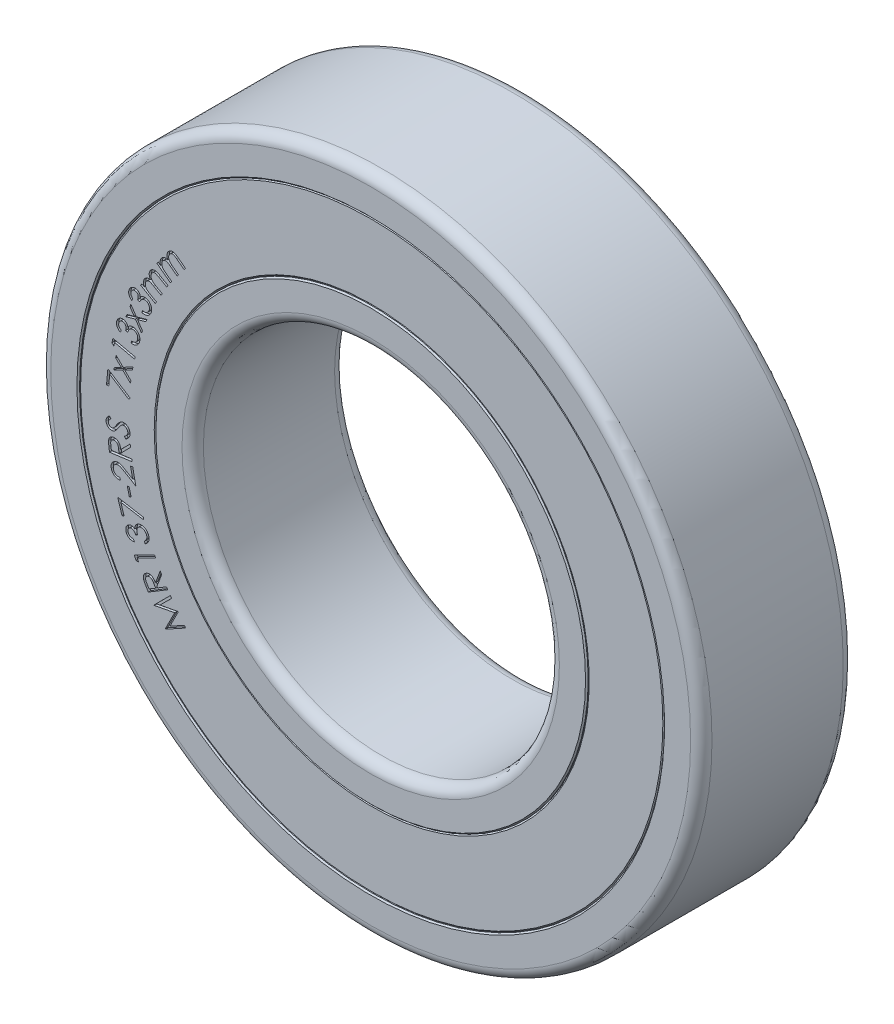
from build123d import *

# Parameters (mm, degrees)
SKETCH_R_INNER_BODY_W          = 3
SKETCH_R_INNER_BODY_H          = 0.75
FILLET_INNER_BODY_R            = 0.21
CHAMFER_INNER_BODY_SIZE        = 0.026
SKETCH_R_OUTER_BODY_W          = 3
SKETCH_R_OUTER_BODY_H          = 0.75
FILLET_OUTER_BODY_R            = 0.21
CHAMFER_OUTER_BODY_SIZE        = 0.026
SKETCH_R_SEAL_FACES_W          = 2.96
SKETCH_R_SEAL_FACES_H          = 1.5
CHAMFER_SEALS_SIZE             = 0.026
CUT_EXTRUDE_SEAL_LABEL_1_DEPTH = 0.05
CUT_EXTRUDE_SEAL_LABEL_2_DEPTH = 0.05


with BuildPart() as part:
    # Sketch R, INNER BODY → Revolve INNER BODY (revolve)
    with BuildSketch(Plane(origin=(0, 0, 0), x_dir=(0, 0, -1), z_dir=(1, 0, 0)), mode=Mode.PRIVATE) as revolve_inner_body_sk:
        with Locations((0, 3.875)):
            Rectangle(SKETCH_R_INNER_BODY_W, SKETCH_R_INNER_BODY_H)
    revolve(revolve_inner_body_sk.sketch.rotate(Axis((0, 0, 17.5), (0, 0, -1)), 90), axis=Axis((0, 0, 17.5), (0, 0, -1)))

    # Fillet INNER BODY
    fillet_inner_body_edges = [part.edges().sort_by_distance(p)[0] for p in [
        (-3.5, 0, -1.5),
        (-3.5, 0, 1.5),
    ]]
    fillet(fillet_inner_body_edges, radius=FILLET_INNER_BODY_R)

    # Chamfer INNER BODY
    chamfer_inner_body_edges = [part.edges().sort_by_distance(p)[0] for p in [
        (-4.25, 0, 1.5),
        (-4.25, 0, -1.5),
    ]]
    chamfer(chamfer_inner_body_edges, length=CHAMFER_INNER_BODY_SIZE)


with BuildPart() as body_2:
    # Sketch R, OUTER BODY → Revolve OUTER BODY (revolve)
    with BuildSketch(Plane(origin=(0, 0, 0), x_dir=(0, 0, -1), z_dir=(1, 0, 0)), mode=Mode.PRIVATE) as revolve_outer_body_sk:
        with Locations((0, 6.125)):
            Rectangle(SKETCH_R_OUTER_BODY_W, SKETCH_R_OUTER_BODY_H)
    revolve(revolve_outer_body_sk.sketch.rotate(Axis((0, 0, 17.5), (0, 0, -1)), 90), axis=Axis((0, 0, 17.5), (0, 0, -1)))

    # Fillet OUTER BODY
    fillet_outer_body_edges = [body_2.edges().sort_by_distance(p)[0] for p in [
        (-6.5, 0, 1.5),
        (-6.5, 0, -1.5),
    ]]
    fillet(fillet_outer_body_edges, radius=FILLET_OUTER_BODY_R)

    # Chamfer OUTER BODY
    chamfer_outer_body_edges = [body_2.edges().sort_by_distance(p)[0] for p in [
        (-5.75, 0, -1.5),
        (-5.75, 0, 1.5),
    ]]
    chamfer(chamfer_outer_body_edges, length=CHAMFER_OUTER_BODY_SIZE)


with BuildPart() as body_3:
    # Sketch R, SEAL FACES → Revolve SEALS (revolve)
    with BuildSketch(Plane(origin=(0, 0, 0), x_dir=(0, 0, -1), z_dir=(1, 0, 0)), mode=Mode.PRIVATE) as revolve_seals_sk:
        with Locations((0, 5)):
            Rectangle(SKETCH_R_SEAL_FACES_W, SKETCH_R_SEAL_FACES_H)
    revolve(revolve_seals_sk.sketch.rotate(Axis((0, 0, 17.5), (0, 0, -1)), 270), axis=Axis((0, 0, 17.5), (0, 0, -1)))

    # Chamfer SEALS
    chamfer_seals_edges = [body_3.edges().sort_by_distance(p)[0] for p in [
        (4.25, 0, -1.48),
        (4.25, 0, 1.48),
        (5.75, 0, 1.48),
        (5.75, 0, -1.48),
    ]]
    chamfer(chamfer_seals_edges, length=CHAMFER_SEALS_SIZE)

    # Sketch TEXT RADIUS 1 — MANUALLY ASSIGN TEXT AND FONT SIZE (FROM EQUATIONS) → Cut-Extrude SEAL LABEL 1 (cut)
    # profile 1 of 17: a face of its own
    with BuildSketch(Plane.XY.offset(1.48)):
        with BuildLine():
            Line((-4.222549472, 2.862902511), (-4.197309088, 2.896526309))
            Line((-4.197309088, 2.896526309), (-4.151786251, 2.862361645))
            add(Edge.make_bspline(
                [(-4.151786251, 2.862361645), (-4.153581432, 2.868223057), (-4.157027767, 2.879475617), (-4.160197573, 2.896115151), (-4.162019544, 2.911608147), (-4.161500207, 2.921523501), (-4.161251395, 2.926273905)],
                knots=[0, 0, 0, 0, 1.130537552, 2.170371631, 3.123432744, 4, 4, 4, 4], degree=3))
            add(Edge.make_bspline(
                [(-4.161251395, 2.926273905), (-4.160437524, 2.93235108), (-4.158837542, 2.944298151), (-4.153402188, 2.961392384), (-4.146088189, 2.977495752), (-4.139436482, 2.987148785), (-4.136101155, 2.991989049)],
                knots=[0, 0, 0, 0, 1.031511749, 2.027840878, 3.011111666, 4, 4, 4, 4], degree=3))
            add(Edge.make_bspline(
                [(-4.136101155, 2.991989049), (-4.133642406, 2.995081666), (-4.128774782, 3.001204168), (-4.120364568, 3.009327947), (-4.111305493, 3.016606816), (-4.101556897, 3.022889572), (-4.091326898, 3.027942053), (-4.081046676, 3.032013576), (-4.070681688, 3.034628196), (-4.06015532, 3.036036773), (-4.049047503, 3.036083832), (-4.037052952, 3.034773418), (-4.024004665, 3.03200364), (-4.015107946, 3.029290145), (-4.010440097, 3.027866453)],
                knots=[0, 0, 0, 0, 1.008484527, 1.99651241, 2.979636898, 3.97411565, 4.952583245, 5.890675565, 6.793716756, 7.67642817, 8.597689655, 9.624360104, 10.753571042, 12, 12, 12, 12], degree=3))
            add(Edge.make_bspline(
                [(-4.010440097, 3.027866453), (-4.013189328, 3.034448947), (-4.018550821, 3.047285987), (-4.023644177, 3.067057582), (-4.026321817, 3.086464278), (-4.026092628, 3.105457367), (-4.02345994, 3.123801106), (-4.018191215, 3.141163557), (-4.010900043, 3.157667371), (-4.004057054, 3.167507349), (-4.000614376, 3.172457799)],
                knots=[0, 0, 0, 0, 1.122636875, 2.189342643, 3.206359611, 4.200544643, 5.171984001, 6.11558309, 7.051958189, 8, 8, 8, 8], degree=3))
            add(Edge.make_bspline(
                [(-4.000614376, 3.172457799), (-3.997129289, 3.17677591), (-3.990296191, 3.185242289), (-3.978152318, 3.195846184), (-3.964937358, 3.20435484), (-3.950701134, 3.210672606), (-3.935738044, 3.214876294), (-3.920243531, 3.216574115), (-3.904422902, 3.215894219), (-3.891044196, 3.21340286), (-3.880002829, 3.210091091), (-3.871115983, 3.20658216), (-3.861666365, 3.202252327), (-3.851676783, 3.197017414), (-3.841201574, 3.190844311), (-3.830197631, 3.183763809), (-3.818581705, 3.175886626), (-3.81080934, 3.17011393), (-3.80680428, 3.16713929)],
                knots=[0, 0, 0, 0, 1.205397639, 2.363384168, 3.489489265, 4.613220033, 5.73928718, 6.857528305, 7.989386985, 9.172834432, 9.807749735, 10.494869927, 11.249596536, 12.068312275, 12.947314736, 13.893921018, 14.914748276, 16, 16, 16, 16], degree=3))
            Line((-3.80680428, 3.16713929), (-3.662934088, 3.059056357))
            Line((-3.662934088, 3.059056357), (-3.68898577, 3.024440972))
            Line((-3.68898577, 3.024440972), (-3.832855963, 3.132523905))
            add(Edge.make_bspline(
                [(-3.832855963, 3.132523905), (-3.836273843, 3.135058034), (-3.842825873, 3.139915925), (-3.852356794, 3.146733455), (-3.861322144, 3.152552998), (-3.869489161, 3.157725287), (-3.876991349, 3.162083283), (-3.883795061, 3.16563528), (-3.88998991, 3.168270209), (-3.897188601, 3.170808145), (-3.90589877, 3.17253073), (-3.916265791, 3.173002075), (-3.926709214, 3.171808313), (-3.937036486, 3.16889358), (-3.947090016, 3.164419487), (-3.956428797, 3.158134621), (-3.965262078, 3.150447936), (-3.970210588, 3.144210614), (-3.972759809, 3.140997463)],
                knots=[0, 0, 0, 0, 1.265629407, 2.426194152, 3.484703327, 4.444418504, 5.301370193, 6.064854092, 6.725582215, 7.302187671, 8.33286061, 9.352742497, 10.378248344, 11.445138978, 12.533233097, 13.636347183, 14.782366199, 16, 16, 16, 16], degree=3))
            add(Edge.make_bspline(
                [(-3.972759809, 3.140997463), (-3.97564261, 3.136816351), (-3.981342191, 3.128549884), (-3.987276716, 3.114651822), (-3.991115397, 3.100042582), (-3.992597453, 3.084805506), (-3.991899288, 3.069404972), (-3.988883444, 3.054255549), (-3.983692218, 3.039531797), (-3.977375746, 3.027749641), (-3.970936638, 3.018289486), (-3.964709553, 3.010734533), (-3.957355971, 3.002623305), (-3.948604216, 2.994201317), (-3.93880308, 2.98514769), (-3.927650319, 2.97571688), (-3.91536867, 2.965715402), (-3.90661537, 2.959089121), (-3.902086732, 2.955660924)],
                knots=[0, 0, 0, 0, 1.082231555, 2.139677362, 3.20735338, 4.297262113, 5.395731824, 6.488055703, 7.583992321, 8.717875851, 9.331911846, 10.025399358, 10.806667161, 11.668811312, 12.617996181, 13.655730748, 14.787160473, 16, 16, 16, 16], degree=3))
            Line((-3.902086732, 2.955660924), (-3.798871588, 2.878136886))
            Line((-3.798871588, 2.878136886), (-3.824202116, 2.844422943))
            Line((-3.824202116, 2.844422943), (-3.95914803, 2.945745059))
            add(Edge.make_bspline(
                [(-3.95914803, 2.945745059), (-3.962993521, 2.948570057), (-3.970360482, 2.953982019), (-3.98094818, 2.961744752), (-3.99091068, 2.968322906), (-3.999875845, 2.974302161), (-4.008172565, 2.979109449), (-4.015585666, 2.983169194), (-4.022217416, 2.986225683), (-4.029860268, 2.989155516), (-4.039014037, 2.991215767), (-4.049896586, 2.992259666), (-4.060782429, 2.99112522), (-4.071502619, 2.988572682), (-4.081849608, 2.984222998), (-4.091466016, 2.97809386), (-4.100351357, 2.97034036), (-4.10538925, 2.964155364), (-4.107976155, 2.960979434)],
                knots=[0, 0, 0, 0, 1.334206562, 2.555993421, 3.669801985, 4.671822628, 5.568057137, 6.349882, 7.034065804, 7.608317053, 8.63538338, 9.647043271, 10.651069471, 11.680092541, 12.719285622, 13.772813078, 14.856362886, 16, 16, 16, 16], degree=3))
            add(Edge.make_bspline(
                [(-4.107976155, 2.960979434), (-4.110737759, 2.956977157), (-4.116219333, 2.949032943), (-4.121851715, 2.935565899), (-4.125595937, 2.92130847), (-4.12717477, 2.906297776), (-4.12663805, 2.891034204), (-4.123947228, 2.875919729), (-4.11887071, 2.861242756), (-4.112850261, 2.849387613), (-4.106650836, 2.839995208), (-4.100933012, 2.832605981), (-4.094204364, 2.824917658), (-4.086483832, 2.816933302), (-4.077659686, 2.808706256), (-4.067820773, 2.800184303), (-4.057059433, 2.79124049), (-4.049375763, 2.785408944), (-4.045416059, 2.782403713)],
                knots=[0, 0, 0, 0, 1.090464446, 2.164488788, 3.260482531, 4.394989792, 5.543941813, 6.683324384, 7.83247492, 9.022637946, 9.661449582, 10.359894929, 11.121099879, 11.95702909, 12.855381137, 13.831984282, 14.882734046, 16, 16, 16, 16], degree=3))
            Line((-4.045416059, 2.782403713), (-3.933727357, 2.698569578))
            Line((-3.933727357, 2.698569578), (-3.958967741, 2.66494578))
            Line((-3.958967741, 2.66494578), (-4.222549472, 2.862902511))
        make_face()
    # profile 2 of 17: a face of its own
    with BuildSketch(Plane.XY.offset(1.48)):
        with BuildLine():
            Line((-4.542027367, 2.328784761), (-4.520843473, 2.365653751))
            Line((-4.520843473, 2.365653751), (-4.471083857, 2.336987886))
            add(Edge.make_bspline(
                [(-4.471083857, 2.336987886), (-4.473587536, 2.342658367), (-4.478380147, 2.353512957), (-4.483697286, 2.369743524), (-4.487379242, 2.385029435), (-4.488124214, 2.395022958), (-4.488481694, 2.399818415)],
                knots=[0, 0, 0, 0, 1.133265217, 2.169327346, 3.121539916, 4, 4, 4, 4], degree=3))
            add(Edge.make_bspline(
                [(-4.488481694, 2.399818415), (-4.488428787, 2.405995158), (-4.488324535, 2.418166327), (-4.484932022, 2.435920811), (-4.479807401, 2.452977783), (-4.474295731, 2.463384876), (-4.471534578, 2.468598463)],
                knots=[0, 0, 0, 0, 1.031871423, 2.033285247, 3.014745336, 4, 4, 4, 4], degree=3))
            add(Edge.make_bspline(
                [(-4.471534578, 2.468598463), (-4.469435445, 2.471977603), (-4.465269808, 2.478683354), (-4.45791657, 2.487921521), (-4.449647927, 2.496272238), (-4.440580524, 2.503680314), (-4.4310754, 2.510140951), (-4.421206361, 2.515335824), (-4.411226971, 2.519355984), (-4.400833392, 2.522023144), (-4.389731631, 2.523496092), (-4.377552016, 2.52357958), (-4.364128344, 2.522484128), (-4.35487668, 2.520842449), (-4.350020155, 2.519980674)],
                knots=[0, 0, 0, 0, 1.006447183, 1.997249158, 2.98160587, 3.976051315, 4.957110538, 5.886060754, 6.794349653, 7.674423507, 8.595334505, 9.622383953, 10.75190553, 12, 12, 12, 12], degree=3))
            add(Edge.make_bspline(
                [(-4.350020155, 2.519980674), (-4.353590978, 2.526246625), (-4.360534943, 2.538431644), (-4.368302849, 2.557541924), (-4.373230853, 2.576680835), (-4.375404038, 2.595699949), (-4.375022515, 2.614377293), (-4.371845084, 2.632389104), (-4.366565635, 2.649842146), (-4.360899604, 2.66053382), (-4.358042992, 2.665924184)],
                knots=[0, 0, 0, 0, 1.125068256, 2.187852817, 3.209590394, 4.201147884, 5.167812601, 6.114882127, 7.049590239, 8, 8, 8, 8], degree=3))
            add(Edge.make_bspline(
                [(-4.358042992, 2.665924184), (-4.355089373, 2.670685247), (-4.349303334, 2.680012009), (-4.338354551, 2.692025316), (-4.326321265, 2.702350902), (-4.31275921, 2.710339972), (-4.298291422, 2.716328226), (-4.282986603, 2.719957512), (-4.267099559, 2.721332233), (-4.253417867, 2.72038292), (-4.241990436, 2.718342049), (-4.232653624, 2.715992308), (-4.222683399, 2.712768586), (-4.212042876, 2.708821984), (-4.200794941, 2.703904733), (-4.188896654, 2.698209219), (-4.176334248, 2.691731027), (-4.167880803, 2.686900402), (-4.163511742, 2.684403751)],
                knots=[0, 0, 0, 0, 1.206862304, 2.364202706, 3.491781808, 4.617289061, 5.745688383, 6.859306836, 7.998333734, 9.174685866, 9.806926576, 10.502117678, 11.250700755, 12.067392164, 12.950417111, 13.898927826, 14.914086079, 16, 16, 16, 16], degree=3))
            Line((-4.163511742, 2.684403751), (-4.006210059, 2.593989088))
            Line((-4.006210059, 2.593989088), (-4.028024963, 2.556128511))
            Line((-4.028024963, 2.556128511), (-4.185326646, 2.646543174))
            add(Edge.make_bspline(
                [(-4.185326646, 2.646543174), (-4.189040954, 2.648667804), (-4.196186178, 2.652754959), (-4.206620053, 2.658278524), (-4.216174919, 2.663248847), (-4.225061557, 2.667265427), (-4.233078766, 2.670736924), (-4.240382523, 2.673347818), (-4.24681716, 2.675417647), (-4.254365031, 2.676960389), (-4.263240944, 2.677635394), (-4.273686784, 2.676847373), (-4.283956907, 2.674249506), (-4.29394127, 2.670087651), (-4.303497642, 2.664446609), (-4.312056724, 2.656969626), (-4.320000132, 2.648207413), (-4.324168315, 2.641334349), (-4.326312223, 2.637799184)],
                knots=[0, 0, 0, 0, 1.262480922, 2.428637145, 3.483370287, 4.439473699, 5.305635243, 6.060089575, 6.727585477, 7.297919034, 8.329479993, 9.343362768, 10.375533171, 11.440833745, 12.526490242, 13.633371462, 14.782723158, 16, 16, 16, 16], degree=3))
            add(Edge.make_bspline(
                [(-4.326312223, 2.637799184), (-4.328702039, 2.633272192), (-4.33342325, 2.624328878), (-4.33758159, 2.609690542), (-4.339623807, 2.594597096), (-4.33919788, 2.579125694), (-4.336621018, 2.563790652), (-4.331809361, 2.548964211), (-4.324628424, 2.535008296), (-4.317004487, 2.523888592), (-4.309388282, 2.515191485), (-4.302213028, 2.508387262), (-4.293778317, 2.501275434), (-4.28409903, 2.493780949), (-4.273118286, 2.485969555), (-4.260811449, 2.477887474), (-4.247300455, 2.469367103), (-4.237719811, 2.463818693), (-4.232742511, 2.460936203)],
                knots=[0, 0, 0, 0, 1.081317963, 2.136201711, 3.201585873, 4.296205138, 5.399700685, 6.484158652, 7.582469729, 8.711978656, 9.329650651, 10.027104158, 10.803466713, 11.665041965, 12.618396463, 13.655985546, 14.782246456, 16, 16, 16, 16], degree=3))
            Line((-4.232742511, 2.460936203), (-4.119972078, 2.396122501))
            Line((-4.119972078, 2.396122501), (-4.141155973, 2.359343655))
            Line((-4.141155973, 2.359343655), (-4.288631934, 2.444169376))
            add(Edge.make_bspline(
                [(-4.288631934, 2.444169376), (-4.292831168, 2.446556465), (-4.30086437, 2.451123002), (-4.312508863, 2.457465916), (-4.323218341, 2.462947044), (-4.332985853, 2.46770637), (-4.341869413, 2.47155764), (-4.349821801, 2.47467481), (-4.356830795, 2.476961218), (-4.364857815, 2.4789001), (-4.374240782, 2.479988742), (-4.385227777, 2.479428152), (-4.395968813, 2.477147733), (-4.406337672, 2.473163239), (-4.416149759, 2.46756859), (-4.425024172, 2.460251345), (-4.43302934, 2.451417064), (-4.437265538, 2.444546345), (-4.439443232, 2.441014328)],
                knots=[0, 0, 0, 0, 1.338860641, 2.561261502, 3.675014182, 4.673355111, 5.572321965, 6.35805628, 7.040252977, 7.613971439, 8.645024363, 9.645724947, 10.650334465, 11.67585566, 12.713046357, 13.766693001, 14.851928475, 16, 16, 16, 16], degree=3))
            add(Edge.make_bspline(
                [(-4.439443232, 2.441014328), (-4.441692877, 2.43669037), (-4.446175629, 2.428074237), (-4.450303355, 2.413964133), (-4.452137939, 2.399188147), (-4.45199289, 2.383977562), (-4.449551007, 2.368761513), (-4.444912402, 2.353995205), (-4.438050113, 2.339931214), (-4.430626087, 2.328760283), (-4.423165772, 2.320227636), (-4.416614646, 2.313441546), (-4.408878137, 2.306611783), (-4.400116472, 2.299585145), (-4.390311281, 2.292396712), (-4.379406925, 2.285108241), (-4.367560287, 2.277500154), (-4.359145163, 2.272621331), (-4.354797799, 2.270100867)],
                knots=[0, 0, 0, 0, 1.084739593, 2.161505494, 3.255904983, 4.3948985, 5.541472169, 6.679302613, 7.832900964, 9.020244101, 9.656802207, 10.357980796, 11.121870501, 11.955762945, 12.861583668, 13.831531278, 14.87974052, 16, 16, 16, 16], degree=3))
            Line((-4.354797799, 2.270100867), (-4.232742511, 2.199968655))
            Line((-4.232742511, 2.199968655), (-4.253926405, 2.163099665))
            Line((-4.253926405, 2.163099665), (-4.542027367, 2.328784761))
        make_face()
    # profile 3 of 17: a face of its own
    with BuildSketch(Plane.XY.offset(1.48)):
        with BuildLine():
            Line((-4.697973394, 2.022949607), (-4.71663325, 1.981573405))
            add(Edge.make_bspline(
                [(-4.71663325, 1.981573405), (-4.720280778, 1.984407646), (-4.727405756, 1.989943972), (-4.737185614, 1.998938141), (-4.74597054, 2.008232143), (-4.7537382, 2.017864774), (-4.760465958, 2.027846874), (-4.7661508, 2.038140849), (-4.770879738, 2.04874848), (-4.774587088, 2.059636553), (-4.777162528, 2.070698479), (-4.778807702, 2.081761971), (-4.779483339, 2.092808218), (-4.778956514, 2.103843684), (-4.777666212, 2.114899982), (-4.775174902, 2.12589682), (-4.771765686, 2.136885496), (-4.768739246, 2.144006922), (-4.767204163, 2.147619078)],
                knots=[0, 0, 0, 0, 1.172642756, 2.290607226, 3.370232139, 4.417748044, 5.429380087, 6.423272755, 7.40026648, 8.375142173, 9.339448493, 10.280467958, 11.212940576, 12.144663567, 13.082615139, 14.036082289, 15.003854367, 16, 16, 16, 16], degree=3))
            add(Edge.make_bspline(
                [(-4.767204163, 2.147619078), (-4.764696152, 2.152775225), (-4.759738139, 2.162968261), (-4.749953022, 2.176818514), (-4.738877064, 2.189452447), (-4.726257661, 2.200481435), (-4.712652262, 2.209821983), (-4.698301045, 2.217265844), (-4.683313793, 2.222403952), (-4.667970999, 2.225480512), (-4.652659244, 2.226456993), (-4.637708836, 2.225502043), (-4.623280102, 2.222482881), (-4.614244946, 2.218849106), (-4.609722192, 2.217030136)],
                knots=[0, 0, 0, 0, 1.079731914, 2.134490332, 3.186276199, 4.242312523, 5.28597637, 6.292120656, 7.281351044, 8.263773563, 9.234787659, 10.166219927, 11.082059286, 12, 12, 12, 12], degree=3))
            add(Edge.make_bspline(
                [(-4.609722192, 2.217030136), (-4.605505545, 2.214956945), (-4.597226001, 2.210886157), (-4.586171646, 2.202802379), (-4.57645988, 2.193545692), (-4.568289721, 2.182836982), (-4.561497792, 2.170858952), (-4.556171551, 2.157546465), (-4.55227601, 2.142919179), (-4.550865679, 2.132645703), (-4.550136855, 2.127336627)],
                knots=[0, 0, 0, 0, 0.994855121, 1.953435269, 2.890854748, 3.831495944, 4.798952316, 5.802423526, 6.864347157, 8, 8, 8, 8], degree=3))
            add(Edge.make_bspline(
                [(-4.550136855, 2.127336627), (-4.545901066, 2.131119023), (-4.537581822, 2.138547786), (-4.523672779, 2.147569691), (-4.509092836, 2.154884806), (-4.498777949, 2.158093026), (-4.493616423, 2.159698405)],
                knots=[0, 0, 0, 0, 1.034665591, 2.032120531, 3.015281373, 4, 4, 4, 4], degree=3))
            add(Edge.make_bspline(
                [(-4.493616423, 2.159698405), (-4.48996431, 2.160607313), (-4.482776024, 2.162396274), (-4.47187253, 2.163885698), (-4.461113846, 2.164531104), (-4.450459637, 2.164297872), (-4.43993878, 2.16298701), (-4.429548441, 2.160852558), (-4.419296823, 2.157674538), (-4.412675536, 2.154886504), (-4.409331567, 2.153478453)],
                knots=[0, 0, 0, 0, 1.046443621, 2.059666922, 3.056232982, 4.043038052, 5.019841521, 6.001961015, 6.990923888, 8, 8, 8, 8], degree=3))
            add(Edge.make_bspline(
                [(-4.409331567, 2.153478453), (-4.403745741, 2.150683122), (-4.392588887, 2.145099865), (-4.37734873, 2.133994264), (-4.363552919, 2.120818435), (-4.353452243, 2.10822736), (-4.346158947, 2.097452408), (-4.341372519, 2.088981862), (-4.337134818, 2.08035375), (-4.333487062, 2.071518285), (-4.330641357, 2.062418604), (-4.328236116, 2.053169737), (-4.326673654, 2.043628824), (-4.325190863, 2.030723012), (-4.325052457, 2.014333141), (-4.327588556, 1.994666012), (-4.332478688, 1.974971498), (-4.337711508, 1.962315203), (-4.34037123, 1.9558823)],
                knots=[0, 0, 0, 0, 1.284111293, 2.56482104, 3.864276336, 5.201335786, 5.879018038, 6.541163961, 7.202355679, 7.857121274, 8.506605941, 9.163734107, 9.822723006, 10.494905926, 11.837292127, 13.183833628, 14.568607418, 16, 16, 16, 16], degree=3))
            add(Edge.make_bspline(
                [(-4.34037123, 1.9558823), (-4.342409276, 1.951641274), (-4.346403446, 1.943329694), (-4.353413199, 1.93163931), (-4.361056486, 1.920871065), (-4.36946892, 1.911084908), (-4.378600669, 1.902320014), (-4.388411782, 1.894509777), (-4.398894371, 1.887625564), (-4.410091321, 1.881758493), (-4.421895722, 1.876985176), (-4.434270127, 1.873341477), (-4.447168126, 1.87092615), (-4.460624185, 1.869705403), (-4.474617502, 1.869477002), (-4.489161528, 1.87067167), (-4.504267617, 1.872770514), (-4.514394459, 1.875095091), (-4.519577961, 1.876284944)],
                knots=[0, 0, 0, 0, 1.047142265, 2.052194021, 3.030528655, 3.984004469, 4.92083588, 5.844436243, 6.772194594, 7.708811001, 8.654202471, 9.602571708, 10.576137081, 11.570669132, 12.607697163, 13.687766189, 14.816465451, 16, 16, 16, 16], degree=3))
            Line((-4.519577961, 1.876284944), (-4.501639259, 1.91603855))
            add(Edge.make_bspline(
                [(-4.501639259, 1.91603855), (-4.498067899, 1.915494732), (-4.49109389, 1.914432788), (-4.480866072, 1.913436157), (-4.471171577, 1.913040989), (-4.46205016, 1.913332254), (-4.453453011, 1.914086307), (-4.445443145, 1.91555068), (-4.437929734, 1.917481945), (-4.433262988, 1.91935398), (-4.430966182, 1.920275328)],
                knots=[0, 0, 0, 0, 1.208290646, 2.359501166, 3.435779306, 4.451444011, 5.410626658, 6.319565136, 7.172949889, 8, 8, 8, 8], degree=3))
            add(Edge.make_bspline(
                [(-4.430966182, 1.920275328), (-4.42820312, 1.92160359), (-4.422711224, 1.924243658), (-4.414990734, 1.929158184), (-4.40788514, 1.934899147), (-4.40114102, 1.941240224), (-4.394887278, 1.948350618), (-4.389372032, 1.956362835), (-4.384130946, 1.96496009), (-4.381183469, 1.971118237), (-4.379674115, 1.974271723)],
                knots=[0, 0, 0, 0, 0.965153361, 1.918350426, 2.8747848, 3.838962953, 4.831800346, 5.850735506, 6.899397105, 8, 8, 8, 8], degree=3))
            add(Edge.make_bspline(
                [(-4.379674115, 1.974271723), (-4.378100479, 1.977910591), (-4.375039486, 1.984988815), (-4.371725863, 1.995852652), (-4.369339834, 2.006483266), (-4.368021292, 2.016992453), (-4.367983062, 2.027326472), (-4.368846664, 2.037480446), (-4.370847157, 2.047457248), (-4.373937135, 2.057159524), (-4.377843321, 2.066419518), (-4.382496539, 2.075057713), (-4.387702273, 2.083050319), (-4.393685339, 2.090281147), (-4.40032855, 2.096798188), (-4.407532729, 2.102726971), (-4.415541723, 2.107779231), (-4.421234162, 2.110589681), (-4.424115221, 2.112012107)],
                knots=[0, 0, 0, 0, 1.17678545, 2.289050168, 3.367497303, 4.410344248, 5.427866681, 6.431475981, 7.432701218, 8.443271322, 9.451157723, 10.413517787, 11.354194448, 12.279846632, 13.194982896, 14.114980938, 15.045953499, 16, 16, 16, 16], degree=3))
            add(Edge.make_bspline(
                [(-4.424115221, 2.112012107), (-4.428100255, 2.113614932), (-4.435990835, 2.11678861), (-4.448615641, 2.119258722), (-4.461535383, 2.11997359), (-4.474672951, 2.118887068), (-4.487554883, 2.116016845), (-4.499935392, 2.111477657), (-4.511521497, 2.105106808), (-4.520543234, 2.098355237), (-4.527476731, 2.091904824), (-4.532787289, 2.086100126), (-4.538157169, 2.079412979), (-4.543708097, 2.071895019), (-4.549232032, 2.063426317), (-4.554915274, 2.054091743), (-4.560806354, 2.043949775), (-4.564530417, 2.036758335), (-4.566452961, 2.033045761)],
                knots=[0, 0, 0, 0, 1.127008758, 2.231537706, 3.362856476, 4.519994757, 5.685193072, 6.822342854, 7.974726344, 9.148514182, 9.774479432, 10.462052799, 11.214572105, 12.028204243, 12.91767163, 13.871388304, 14.901106079, 16, 16, 16, 16], degree=3))
            Line((-4.566452961, 2.033045761), (-4.603682528, 2.049812588))
            add(Edge.make_bspline(
                [(-4.603682528, 2.049812588), (-4.601759167, 2.054406659), (-4.597972838, 2.063450547), (-4.593933255, 2.077380761), (-4.591356325, 2.091241576), (-4.590387154, 2.104846823), (-4.590789668, 2.117786002), (-4.592535011, 2.129668208), (-4.595634611, 2.14032954), (-4.600332029, 2.149600993), (-4.606063463, 2.157730802), (-4.612781506, 2.164712718), (-4.620413103, 2.170623808), (-4.626134375, 2.173490428), (-4.629013057, 2.17493278)],
                knots=[0, 0, 0, 0, 1.261859092, 2.484095615, 3.669011202, 4.829979635, 5.935250188, 6.944775404, 7.86781508, 8.736570902, 9.567250372, 10.380811509, 11.185298323, 12, 12, 12, 12], degree=3))
            add(Edge.make_bspline(
                [(-4.629013057, 2.17493278), (-4.631217045, 2.175859869), (-4.63557348, 2.177692364), (-4.642376407, 2.179442428), (-4.649194894, 2.180551864), (-4.656120176, 2.180938431), (-4.663126719, 2.180442603), (-4.670210128, 2.179303888), (-4.677303582, 2.17722661), (-4.684449052, 2.174587331), (-4.691385558, 2.171192578), (-4.697992959, 2.167185934), (-4.704076415, 2.162509823), (-4.709761154, 2.157203644), (-4.71493916, 2.151253004), (-4.719771427, 2.144752826), (-4.724008567, 2.137553852), (-4.726465112, 2.132463199), (-4.72772099, 2.129860665)],
                knots=[0, 0, 0, 0, 0.949102756, 1.876010097, 2.783011723, 3.691819579, 4.625165983, 5.569448634, 6.537223565, 7.557503219, 8.593593503, 9.601215855, 10.623450337, 11.637280447, 12.686500171, 13.754110342, 14.851816626, 16, 16, 16, 16], degree=3))
            add(Edge.make_bspline(
                [(-4.72772099, 2.129860665), (-4.729451794, 2.125549331), (-4.732840405, 2.117108493), (-4.735496339, 2.10387053), (-4.735726002, 2.090704606), (-4.734185279, 2.079829559), (-4.731667819, 2.071219573), (-4.729023396, 2.064620151), (-4.725653818, 2.057892438), (-4.721509035, 2.051111664), (-4.71667081, 2.044204812), (-4.711150834, 2.037150047), (-4.704885441, 2.029992996), (-4.700310629, 2.025331255), (-4.697973394, 2.022949607)],
                knots=[0, 0, 0, 0, 1.398232072, 2.737493818, 4.041974078, 5.351005321, 6.030274729, 6.741690312, 7.491010646, 8.29560009, 9.134772008, 10.031590575, 10.994354954, 12, 12, 12, 12], degree=3))
        make_face()
    # profile 4 of 17: a face of its own
    with BuildSketch(Plane.XY.offset(1.48)):
        Polygon((-4.830884638, 1.64937753), (-4.813216368, 1.697153972), (-4.668174301, 1.73672729), (-4.752549301, 1.861036184), (-4.734881032, 1.908902771), (-4.626888243, 1.748626328), (-4.420367811, 1.807760944), (-4.438216368, 1.759353492), (-4.603270455, 1.71265878), (-4.507807714, 1.571312626), (-4.525385839, 1.523806617), (-4.644466368, 1.701120319), align=None)
    # profile 5 of 17: a face of its own
    with BuildSketch(Plane.XY.offset(1.48)):
        with BuildLine():
            Line((-4.92749081, 1.371233899), (-4.940471579, 1.327694236))
            add(Edge.make_bspline(
                [(-4.940471579, 1.327694236), (-4.944440768, 1.330015671), (-4.95223182, 1.334572376), (-4.963134836, 1.342166735), (-4.973137543, 1.350177499), (-4.982036748, 1.358795709), (-4.990130351, 1.367708616), (-4.997224125, 1.377134867), (-5.003239996, 1.387062779), (-5.008337561, 1.397370574), (-5.012321141, 1.407999162), (-5.015560923, 1.41872786), (-5.017608337, 1.429608198), (-5.018710433, 1.440587785), (-5.018783171, 1.451690244), (-5.017900438, 1.462918644), (-5.015874025, 1.474245318), (-5.013873407, 1.481733779), (-5.012857396, 1.485536784)],
                knots=[0, 0, 0, 0, 1.167030128, 2.290743179, 3.370183069, 4.416912914, 5.432487786, 6.424230303, 7.406805244, 8.375751496, 9.339186251, 10.2854636, 11.217581696, 12.145193454, 13.083565462, 14.032606387, 15.000861661, 16, 16, 16, 16], degree=3))
            add(Edge.make_bspline(
                [(-5.012857396, 1.485536784), (-5.011039093, 1.490969393), (-5.007444433, 1.501709283), (-4.999733561, 1.516767336), (-4.990374781, 1.530682186), (-4.97941607, 1.543334158), (-4.967189099, 1.554462045), (-4.953887758, 1.563688798), (-4.939759521, 1.570877245), (-4.924924376, 1.57587671), (-4.909900612, 1.578998278), (-4.894949651, 1.579854087), (-4.88025663, 1.578917837), (-4.870824333, 1.576520519), (-4.866102589, 1.575320438)],
                knots=[0, 0, 0, 0, 1.079553628, 2.134202131, 3.1797617, 4.236738633, 5.284248087, 6.290639282, 7.281908978, 8.264304831, 9.235978174, 10.16739505, 11.082610319, 12, 12, 12, 12], degree=3))
            add(Edge.make_bspline(
                [(-4.866102589, 1.575320438), (-4.861667875, 1.573815047), (-4.852951431, 1.570856197), (-4.840854526, 1.564458967), (-4.829994221, 1.556554195), (-4.820439754, 1.547034362), (-4.812111984, 1.536046417), (-4.805047761, 1.523552426), (-4.799260085, 1.509578919), (-4.796494679, 1.499603849), (-4.795068935, 1.494461063)],
                knots=[0, 0, 0, 0, 0.992242366, 1.950255888, 2.889877504, 3.831895925, 4.800789604, 5.805665771, 6.868680413, 8, 8, 8, 8], degree=3))
            add(Edge.make_bspline(
                [(-4.795068935, 1.494461063), (-4.791384212, 1.498765322), (-4.78413659, 1.507231536), (-4.771645226, 1.518107265), (-4.758108405, 1.527208217), (-4.748321751, 1.531755234), (-4.743416291, 1.53403438)],
                knots=[0, 0, 0, 0, 1.033267937, 2.032374517, 3.01374771, 4, 4, 4, 4], degree=3))
            add(Edge.make_bspline(
                [(-4.743416291, 1.53403438), (-4.73992053, 1.535412486), (-4.73301738, 1.538133861), (-4.722434933, 1.541198405), (-4.711849254, 1.543300868), (-4.701254894, 1.544364373), (-4.690700224, 1.544553031), (-4.680141872, 1.54382829), (-4.669566634, 1.542150111), (-4.66263159, 1.54023122), (-4.659131435, 1.539262745)],
                knots=[0, 0, 0, 0, 1.045693299, 2.064951966, 3.062453487, 4.046356976, 5.025268894, 5.997977275, 6.989568041, 8, 8, 8, 8], degree=3))
            add(Edge.make_bspline(
                [(-4.659131435, 1.539262745), (-4.653207223, 1.537226818), (-4.641415163, 1.533174334), (-4.624798142, 1.52424039), (-4.609452884, 1.512956084), (-4.597700692, 1.501904765), (-4.589142228, 1.492117883), (-4.583135663, 1.484463966), (-4.577858226, 1.476443484), (-4.573120106, 1.468169465), (-4.568950502, 1.459602755), (-4.565465099, 1.450699189), (-4.56256195, 1.441509248), (-4.559436902, 1.428923201), (-4.5571075, 1.412704998), (-4.556884216, 1.392874269), (-4.559045528, 1.372694969), (-4.562587675, 1.35947857), (-4.564389848, 1.352754332)],
                knots=[0, 0, 0, 0, 1.28873018, 2.565199616, 3.867561273, 5.202991645, 5.878400617, 6.544471491, 7.205374807, 7.854080102, 8.50737535, 9.165956033, 9.821709487, 10.491222315, 11.835701225, 13.185114645, 14.567842929, 16, 16, 16, 16], degree=3))
            add(Edge.make_bspline(
                [(-4.564389848, 1.352754332), (-4.565820709, 1.348281639), (-4.568626244, 1.33951189), (-4.573990971, 1.326989464), (-4.580219899, 1.315377537), (-4.587178517, 1.304531634), (-4.595038844, 1.294609063), (-4.603721798, 1.285540853), (-4.613263566, 1.277402111), (-4.623522842, 1.270086093), (-4.634558325, 1.263743129), (-4.646341973, 1.258503081), (-4.658816, 1.254357469), (-4.671980114, 1.251324654), (-4.685807643, 1.249194569), (-4.700344227, 1.248410304), (-4.715561143, 1.248400223), (-4.725872842, 1.249391713), (-4.731156675, 1.249899765)],
                knots=[0, 0, 0, 0, 1.046100481, 2.051121844, 3.030769882, 3.979915533, 4.919063523, 5.84733368, 6.773403254, 7.70987356, 8.651763038, 9.605010114, 10.579103793, 11.576421327, 12.612485902, 13.692687673, 14.817706703, 16, 16, 16, 16], degree=3))
            Line((-4.731156675, 1.249899765), (-4.718716771, 1.291636543))
            add(Edge.make_bspline(
                [(-4.718716771, 1.291636543), (-4.715080913, 1.291567791), (-4.70801636, 1.291434202), (-4.697750351, 1.291877132), (-4.688126749, 1.292895852), (-4.679108421, 1.29427841), (-4.670712426, 1.296283428), (-4.662918642, 1.298691228), (-4.655733249, 1.301628046), (-4.651355623, 1.304120165), (-4.649215569, 1.305338466)],
                knots=[0, 0, 0, 0, 1.215877744, 2.362477585, 3.433310029, 4.450913814, 5.411190615, 6.31692612, 7.177209822, 8, 8, 8, 8], degree=3))
            add(Edge.make_bspline(
                [(-4.649215569, 1.305338466), (-4.646654134, 1.307030326), (-4.641564168, 1.310392311), (-4.634616738, 1.316320649), (-4.628207306, 1.32286721), (-4.622510666, 1.330166284), (-4.61728498, 1.338060719), (-4.612837692, 1.346681672), (-4.608784945, 1.355894796), (-4.606727262, 1.362407494), (-4.605675906, 1.365735101)],
                knots=[0, 0, 0, 0, 0.966419224, 1.920423409, 2.871133534, 3.848481433, 4.83318427, 5.849555043, 6.901248763, 8, 8, 8, 8], degree=3))
            add(Edge.make_bspline(
                [(-4.605675906, 1.365735101), (-4.604615699, 1.369534675), (-4.602539333, 1.37697596), (-4.600650004, 1.388181072), (-4.599880839, 1.399041568), (-4.599852459, 1.409585649), (-4.601198363, 1.419816621), (-4.603397502, 1.42977857), (-4.606803123, 1.439393894), (-4.611106484, 1.448622332), (-4.616189416, 1.457277682), (-4.621918488, 1.465224546), (-4.628263464, 1.472344372), (-4.635077782, 1.478798678), (-4.642572434, 1.484309948), (-4.650518476, 1.489115196), (-4.659054786, 1.493156745), (-4.665085879, 1.495098484), (-4.668145858, 1.496083659)],
                knots=[0, 0, 0, 0, 1.172245246, 2.29578692, 3.37083133, 4.407168929, 5.424385412, 6.432142878, 7.435137382, 8.450311891, 9.455412819, 10.415017584, 11.35796878, 12.287107467, 13.200129695, 14.117860052, 15.045064061, 16, 16, 16, 16], degree=3))
            add(Edge.make_bspline(
                [(-4.668145858, 1.496083659), (-4.672299047, 1.497150759), (-4.680574491, 1.499277011), (-4.693421485, 1.500044402), (-4.706361169, 1.499212366), (-4.719199939, 1.496234906), (-4.731620616, 1.491730586), (-4.743282099, 1.485522067), (-4.753853235, 1.47759045), (-4.761893615, 1.469725148), (-4.767915028, 1.462406902), (-4.772342832, 1.455899846), (-4.776891102, 1.448597117), (-4.781272954, 1.440343173), (-4.785665764, 1.431250651), (-4.790109385, 1.421279913), (-4.79450552, 1.410428455), (-4.797257593, 1.402823937), (-4.798674704, 1.398908178)],
                knots=[0, 0, 0, 0, 1.124723197, 2.241069333, 3.365293331, 4.522568475, 5.691880322, 6.829588046, 7.981054963, 9.153828763, 9.776731679, 10.469015116, 11.220773584, 12.037011096, 12.92357491, 13.874594011, 14.905574731, 16, 16, 16, 16], degree=3))
            Line((-4.798674704, 1.398908178), (-4.8377973, 1.410536784))
            add(Edge.make_bspline(
                [(-4.8377973, 1.410536784), (-4.836502344, 1.41535351), (-4.833959909, 1.424810368), (-4.831794666, 1.439130991), (-4.831156459, 1.453179372), (-4.83195136, 1.466775631), (-4.834046456, 1.479507571), (-4.837348066, 1.491050408), (-4.841929053, 1.501170092), (-4.847771379, 1.509812135), (-4.85451044, 1.51712048), (-4.862078284, 1.523138037), (-4.870436109, 1.527928639), (-4.876489108, 1.530011722), (-4.879534079, 1.53105962)],
                knots=[0, 0, 0, 0, 1.264899022, 2.483423332, 3.666459112, 4.827445965, 5.933029988, 6.934309549, 7.86571177, 8.739099768, 9.570019067, 10.378562737, 11.184333406, 12, 12, 12, 12], degree=3))
            add(Edge.make_bspline(
                [(-4.879534079, 1.53105962), (-4.881835824, 1.531688659), (-4.886391053, 1.532933547), (-4.893361282, 1.533767672), (-4.90028042, 1.534006803), (-4.907168192, 1.533322573), (-4.914069403, 1.531993102), (-4.920910976, 1.529790556), (-4.92774382, 1.526887248), (-4.934422513, 1.523198493), (-4.940879323, 1.518928668), (-4.946856946, 1.514034345), (-4.952296636, 1.508601978), (-4.957199406, 1.502580346), (-4.961605493, 1.496047493), (-4.965404722, 1.488894902), (-4.968772521, 1.481255117), (-4.970507697, 1.475849038), (-4.97139105, 1.47309688)],
                knots=[0, 0, 0, 0, 0.946433486, 1.873023076, 2.780276664, 3.691055101, 4.615490545, 5.56657705, 6.539644492, 7.559654913, 8.592291939, 9.609926177, 10.622510089, 11.640144327, 12.689335244, 13.746503885, 14.852777233, 16, 16, 16, 16], degree=3))
            add(Edge.make_bspline(
                [(-4.97139105, 1.47309688), (-4.97258137, 1.468588345), (-4.974903848, 1.459791574), (-4.975487017, 1.446352358), (-4.974219866, 1.433300196), (-4.971112335, 1.422777639), (-4.967356769, 1.414610489), (-4.96386744, 1.408401544), (-4.959542705, 1.402243112), (-4.95459638, 1.396022721), (-4.9488898, 1.389803178), (-4.942434543, 1.383560599), (-4.935285381, 1.377287254), (-4.930126496, 1.373280804), (-4.92749081, 1.371233899)],
                knots=[0, 0, 0, 0, 1.402439207, 2.736351711, 4.030147672, 5.343248742, 6.02039022, 6.738542914, 7.487528636, 8.287040712, 9.133634252, 10.030701864, 10.993880963, 12, 12, 12, 12], degree=3))
        make_face()
    # profile 6 of 17: a face of its own
    with BuildSketch(Plane.XY.offset(1.48)):
        Polygon((-5.10721674, 1.067683332), (-5.087745586, 1.153140063), (-4.652619384, 1.054341986), (-4.662445105, 1.011162899), (-5.054933086, 1.100315543), (-5.070437894, 1.031986216), align=None)
    # profile 7 of 17: a face of its own
    with BuildSketch(Plane.XY.offset(1.48)):
        Polygon((-5.068371943, 0.62178014), (-5.060439251, 0.672441197), (-4.925313049, 0.740229659), (-5.033215693, 0.846058986), (-5.025283001, 0.896720043), (-4.887001751, 0.760151534), (-4.695174828, 0.859490476), (-4.703197664, 0.808198409), (-4.856623145, 0.729412351), (-4.734387568, 0.608979659), (-4.74232026, 0.558679178), (-4.894934443, 0.709760909), align=None)
    # profile 8 of 17: a face of its own
    with BuildSketch(Plane.XY.offset(1.48)):
        Polygon((-5.21362587, 0.301363929), (-5.187754476, 0.585228111), (-4.750735245, 0.304068256), (-4.772910726, 0.26900215), (-5.151786928, 0.512030996), (-5.171348226, 0.297487727), align=None)
    # profile 9 of 17: a face of its own
    with BuildSketch(Plane.XY.offset(1.48)):
        with BuildLine():
            Line((-4.838571369, -0.437339506), (-4.863631466, -0.400650804))
            add(Edge.make_bspline(
                [(-4.863631466, -0.400650804), (-4.858002684, -0.396992952), (-4.847227929, -0.389990999), (-4.83283395, -0.378366818), (-4.820602068, -0.366630634), (-4.810869102, -0.354445429), (-4.803277624, -0.342113229), (-4.798153043, -0.329419968), (-4.795256668, -0.316438896), (-4.79534719, -0.307725582), (-4.795392283, -0.303385179)],
                knots=[0, 0, 0, 0, 1.29047272, 2.470255192, 3.55337114, 4.544492507, 5.462378596, 6.328526614, 7.167381174, 8, 8, 8, 8], degree=3))
            add(Edge.make_bspline(
                [(-4.795392283, -0.303385179), (-4.795751695, -0.299675381), (-4.796463557, -0.292327637), (-4.799132706, -0.281593491), (-4.803138663, -0.271343599), (-4.808369367, -0.261644687), (-4.814550187, -0.25273353), (-4.821687454, -0.244917742), (-4.829661885, -0.238369867), (-4.838422554, -0.233175782), (-4.847617159, -0.229214593), (-4.857082747, -0.226453581), (-4.866804617, -0.225034243), (-4.873333466, -0.225224652), (-4.876612235, -0.225320275)],
                knots=[0, 0, 0, 0, 1.069893688, 2.119065424, 3.16610325, 4.224577873, 5.278535112, 6.274634263, 7.256372098, 8.232206924, 9.191358924, 10.1259455, 11.058855399, 12, 12, 12, 12], degree=3))
            add(Edge.make_bspline(
                [(-4.876612235, -0.225320275), (-4.880335223, -0.225729485), (-4.88786565, -0.226557187), (-4.898840541, -0.230282931), (-4.909692246, -0.23560209), (-4.916288044, -0.240529103), (-4.919701177, -0.243078689)],
                knots=[0, 0, 0, 0, 0.947396293, 1.916282626, 2.921736825, 4, 4, 4, 4], degree=3))
            add(Edge.make_bspline(
                [(-4.919701177, -0.243078689), (-4.922158137, -0.245156045), (-4.927293202, -0.249497734), (-4.934923009, -0.256890296), (-4.942759198, -0.265441301), (-4.951018547, -0.275045031), (-4.959512172, -0.28575305), (-4.96841857, -0.297537278), (-4.977538058, -0.310467304), (-4.98363163, -0.319538709), (-4.986768485, -0.324208496)],
                knots=[0, 0, 0, 0, 0.730946359, 1.527683329, 2.41183716, 3.365688693, 4.405338713, 5.516891168, 6.721742758, 8, 8, 8, 8], degree=3))
            add(Edge.make_bspline(
                [(-4.986768485, -0.324208496), (-4.989880678, -0.328874533), (-4.99583267, -0.337798213), (-5.004540165, -0.350417404), (-5.012699081, -0.361625715), (-5.020118879, -0.371508687), (-5.026886302, -0.380039587), (-5.033011579, -0.387172337), (-5.038453934, -0.393022393), (-5.04209429, -0.396227443), (-5.043739639, -0.397676044)],
                knots=[0, 0, 0, 0, 1.444412558, 2.762403206, 3.948057286, 5.01440047, 5.944962039, 6.751566863, 7.43573998, 8, 8, 8, 8], degree=3))
            add(Edge.make_bspline(
                [(-5.043739639, -0.397676044), (-5.046264412, -0.399727968), (-5.051241357, -0.403772812), (-5.059138844, -0.40910892), (-5.067209088, -0.413710506), (-5.075524709, -0.417505992), (-5.083986129, -0.420738869), (-5.092744174, -0.422978614), (-5.101635519, -0.424827888), (-5.107673024, -0.42529508), (-5.110716802, -0.425530612)],
                knots=[0, 0, 0, 0, 1.057116076, 2.083834149, 3.094208353, 4.073123477, 5.052817915, 6.033680162, 7.008689374, 8, 8, 8, 8], degree=3))
            add(Edge.make_bspline(
                [(-5.110716802, -0.425530612), (-5.11549982, -0.425664708), (-5.124924522, -0.425928938), (-5.138831258, -0.424001259), (-5.152236406, -0.420533901), (-5.164923989, -0.415083429), (-5.17675368, -0.408025848), (-5.187600369, -0.399534078), (-5.197139867, -0.389375713), (-5.205366839, -0.377865859), (-5.212240703, -0.365288788), (-5.217328212, -0.351865407), (-5.221011381, -0.337844618), (-5.221936613, -0.328196526), (-5.222405504, -0.323307054)],
                knots=[0, 0, 0, 0, 1.018606998, 2.007114817, 2.981425238, 3.963100451, 4.939829955, 5.911335142, 6.890184301, 7.900030535, 8.92054958, 9.936574656, 10.954294858, 12, 12, 12, 12], degree=3))
            add(Edge.make_bspline(
                [(-5.222405504, -0.323307054), (-5.222507026, -0.318104452), (-5.222708557, -0.307776742), (-5.220680455, -0.292381756), (-5.216531135, -0.27745636), (-5.21162673, -0.265277217), (-5.206356905, -0.255797735), (-5.201647354, -0.248415605), (-5.196006097, -0.240996395), (-5.189693018, -0.233272647), (-5.182481642, -0.225465109), (-5.174410915, -0.217571471), (-5.165692573, -0.20938125), (-5.159393194, -0.204133992), (-5.156149494, -0.201432054)],
                knots=[0, 0, 0, 0, 1.293528703, 2.567789734, 3.846539734, 5.140630155, 5.823285609, 6.542975535, 7.31758585, 8.14089622, 9.024597268, 9.960407762, 10.949765564, 12, 12, 12, 12], degree=3))
            Line((-5.156149494, -0.201432054), (-5.12622161, -0.236227727))
            add(Edge.make_bspline(
                [(-5.12622161, -0.236227727), (-5.128789269, -0.238435946), (-5.133743211, -0.242696397), (-5.140685217, -0.249102652), (-5.146925891, -0.255219812), (-5.152433327, -0.261107139), (-5.157319435, -0.26666299), (-5.16149283, -0.271977798), (-5.164930542, -0.277052786), (-5.168657329, -0.283320964), (-5.171982347, -0.291284679), (-5.174893459, -0.300998402), (-5.176240439, -0.311129884), (-5.17612822, -0.317955955), (-5.176071369, -0.321414025)],
                knots=[0, 0, 0, 0, 1.184958291, 2.286212091, 3.304806399, 4.242062738, 5.106547722, 5.893161882, 6.604730596, 7.250317603, 8.441788748, 9.613093748, 10.790799368, 12, 12, 12, 12], degree=3))
            add(Edge.make_bspline(
                [(-5.176071369, -0.321414025), (-5.175639636, -0.32574315), (-5.174804163, -0.334120703), (-5.170804086, -0.345836221), (-5.164926764, -0.356200811), (-5.157199359, -0.365017058), (-5.148008846, -0.371929326), (-5.137876994, -0.376893724), (-5.126803071, -0.379492885), (-5.119202429, -0.379416065), (-5.115314158, -0.379376766)],
                knots=[0, 0, 0, 0, 1.109650022, 2.1473516, 3.138685761, 4.140686108, 5.122832877, 6.061188949, 7.008159577, 8, 8, 8, 8], degree=3))
            add(Edge.make_bspline(
                [(-5.115314158, -0.379376766), (-5.112900359, -0.379169208), (-5.108086394, -0.378755264), (-5.101023713, -0.377004059), (-5.09406253, -0.374833306), (-5.08720822, -0.371671248), (-5.080385457, -0.367412071), (-5.073302693, -0.362071397), (-5.066109516, -0.355320576), (-5.061433783, -0.350232528), (-5.058974014, -0.347555852)],
                knots=[0, 0, 0, 0, 0.871880254, 1.738836306, 2.615613107, 3.497591793, 4.450463353, 5.509664198, 6.689905819, 8, 8, 8, 8], degree=3))
            add(Edge.make_bspline(
                [(-5.058974014, -0.347555852), (-5.058150606, -0.34657365), (-5.056179988, -0.344222994), (-5.053104271, -0.339839629), (-5.049095218, -0.334252238), (-5.044354171, -0.327334664), (-5.038866211, -0.319104155), (-5.032531767, -0.309625044), (-5.025408209, -0.298828285), (-5.020473125, -0.291131605), (-5.017868244, -0.287069073)],
                knots=[0, 0, 0, 0, 0.420301616, 1.005886623, 1.755311386, 2.676757919, 3.756676295, 5.000628919, 6.416844887, 8, 8, 8, 8], degree=3))
            add(Edge.make_bspline(
                [(-5.017868244, -0.287069073), (-5.014656926, -0.282178103), (-5.008429607, -0.272693638), (-4.998819642, -0.259283745), (-4.989616542, -0.246922563), (-4.980539223, -0.235788361), (-4.97178643, -0.225747659), (-4.963072302, -0.217008202), (-4.954736913, -0.209295414), (-4.944029176, -0.200735791), (-4.930644979, -0.191986523), (-4.914123055, -0.184130568), (-4.897420722, -0.178694715), (-4.886024324, -0.177501751), (-4.880398292, -0.176912823)],
                knots=[0, 0, 0, 0, 1.151625392, 2.233207386, 3.247018176, 4.184652288, 5.060473778, 5.867697538, 6.612925229, 7.294651813, 8.564478466, 9.749773395, 10.889136138, 12, 12, 12, 12], degree=3))
            add(Edge.make_bspline(
                [(-4.880398292, -0.176912823), (-4.876399717, -0.176757794), (-4.868476588, -0.176450605), (-4.856735857, -0.177656308), (-4.845287209, -0.179731895), (-4.834264228, -0.183249005), (-4.823507365, -0.187754319), (-4.813136858, -0.193570204), (-4.803083626, -0.20057726), (-4.793471008, -0.208608872), (-4.784484666, -0.217451989), (-4.776514883, -0.227008795), (-4.76974946, -0.237208559), (-4.763874848, -0.247859574), (-4.759341827, -0.259217876), (-4.755676672, -0.271044216), (-4.753221153, -0.283497716), (-4.752493473, -0.292017164), (-4.752123052, -0.296353929)],
                knots=[0, 0, 0, 0, 0.985770989, 1.953293453, 2.903864637, 3.850846781, 4.800608722, 5.775961612, 6.777129079, 7.818997121, 8.861839943, 9.882834433, 10.88177766, 11.876616397, 12.877125346, 13.892212393, 14.92704553, 16, 16, 16, 16], degree=3))
            add(Edge.make_bspline(
                [(-4.752123052, -0.296353929), (-4.751979106, -0.299719236), (-4.751693689, -0.306391982), (-4.752213627, -0.316330008), (-4.75323926, -0.32606867), (-4.75508471, -0.335615593), (-4.75757415, -0.344969835), (-4.760874109, -0.354102705), (-4.764742427, -0.363068012), (-4.769353642, -0.371856022), (-4.774820389, -0.380466529), (-4.781117672, -0.388987663), (-4.788530218, -0.397223598), (-4.796592014, -0.405594271), (-4.805804513, -0.413684641), (-4.815842531, -0.421754533), (-4.826808435, -0.429750536), (-4.834579046, -0.43476382), (-4.838571369, -0.437339506)],
                knots=[0, 0, 0, 0, 0.925154952, 1.834401346, 2.731683201, 3.614293148, 4.503637002, 5.389023672, 6.280282154, 7.185206385, 8.11301074, 9.080777842, 10.092935007, 11.155665946, 12.272730121, 13.459147879, 14.694581064, 16, 16, 16, 16], degree=3))
        make_face()
    # profile 10 of 17: a face of its own
    with BuildSketch(Plane.XY.offset(1.48)):
        with BuildLine():
            Line((-5.155490414, -0.819781379), (-5.167299308, -0.731440033))
            add(Edge.make_bspline(
                [(-5.167299308, -0.731440033), (-5.168059035, -0.725521712), (-5.169512076, -0.714202428), (-5.171461388, -0.697954106), (-5.172844544, -0.6831569), (-5.174082369, -0.669825419), (-5.174843499, -0.657920565), (-5.175049565, -0.647488569), (-5.17518858, -0.638522429), (-5.174785153, -0.633061511), (-5.174600991, -0.630568639)],
                knots=[0, 0, 0, 0, 1.41390786, 2.704217313, 3.877456621, 4.935287826, 5.876864661, 6.703071663, 7.407960913, 8, 8, 8, 8], degree=3))
            add(Edge.make_bspline(
                [(-5.174600991, -0.630568639), (-5.174247634, -0.627222455), (-5.173551698, -0.620632161), (-5.171352211, -0.611020928), (-5.168735755, -0.601733165), (-5.165238245, -0.592873135), (-5.16121541, -0.584317575), (-5.156319247, -0.576240871), (-5.150759537, -0.568507231), (-5.144590684, -0.561145551), (-5.137761393, -0.554310081), (-5.130369648, -0.548134626), (-5.122342821, -0.542819786), (-5.113864162, -0.538098288), (-5.104805741, -0.534127617), (-5.095237797, -0.530907967), (-5.085148281, -0.528320959), (-5.078188364, -0.527263149), (-5.074631039, -0.526722485)],
                knots=[0, 0, 0, 0, 1.030886406, 2.030326234, 3.018832625, 3.98733908, 4.947614016, 5.914716837, 6.878742085, 7.86621726, 8.856568562, 9.838136468, 10.814370316, 11.804207105, 12.810883979, 13.842387892, 14.89720994, 16, 16, 16, 16], degree=3))
            add(Edge.make_bspline(
                [(-5.074631039, -0.526722485), (-5.068747191, -0.526138042), (-5.057254258, -0.524996449), (-5.040199975, -0.526078051), (-5.023923301, -0.529243832), (-5.008629327, -0.534940588), (-4.994338522, -0.54255133), (-4.981541371, -0.552540718), (-4.970135884, -0.564493575), (-4.962005772, -0.576089081), (-4.95616913, -0.586416505), (-4.952122801, -0.595104001), (-4.948461172, -0.604611213), (-4.94501421, -0.614885711), (-4.941996644, -0.626007824), (-4.939186594, -0.637904918), (-4.936752117, -0.650627391), (-4.93547408, -0.659409271), (-4.934817337, -0.663922004)],
                knots=[0, 0, 0, 0, 1.272770841, 2.486105917, 3.668745269, 4.834735956, 5.991134011, 7.145498582, 8.318323774, 9.540392887, 10.1871432, 10.873881932, 11.604000669, 12.382346611, 13.208922913, 14.087178428, 15.017060906, 16, 16, 16, 16], degree=3))
            Line((-4.934817337, -0.663922004), (-4.74993152, -0.476962869))
            Line((-4.74993152, -0.476962869), (-4.742629837, -0.531860706))
            Line((-4.742629837, -0.531860706), (-4.927605799, -0.718459264))
            Line((-4.927605799, -0.718459264), (-4.924180318, -0.743789793))
            Line((-4.924180318, -0.743789793), (-4.718020462, -0.716295802))
            Line((-4.718020462, -0.716295802), (-4.712070943, -0.760646764))
            Line((-4.712070943, -0.760646764), (-5.155490414, -0.819781379))
        make_face()
        with BuildLine():
            Line((-5.117990414, -0.769661187), (-4.96726926, -0.749559023))
            Line((-4.96726926, -0.749559023), (-4.976914693, -0.67320686))
            add(Edge.make_bspline(
                [(-4.976914693, -0.67320686), (-4.977403179, -0.669627775), (-4.978345288, -0.662725046), (-4.980071707, -0.652776063), (-4.981940807, -0.64360132), (-4.984002059, -0.635175505), (-4.986288146, -0.627526895), (-4.988537009, -0.620547935), (-4.991207964, -0.61441831), (-4.994739389, -0.60722295), (-4.999934839, -0.599321082), (-5.00736212, -0.591187114), (-5.015801675, -0.584274283), (-5.025413843, -0.579087947), (-5.035584817, -0.575016281), (-5.046305487, -0.572732211), (-5.057357961, -0.571831428), (-5.064747635, -0.572524357), (-5.068501231, -0.572876331)],
                knots=[0, 0, 0, 0, 1.119443569, 2.158992007, 3.128793973, 4.020953071, 4.846046466, 5.602887539, 6.291323211, 6.916027573, 8.086077332, 9.206759738, 10.319365047, 11.449103542, 12.578381357, 13.703620186, 14.833550574, 16, 16, 16, 16], degree=3))
            add(Edge.make_bspline(
                [(-5.068501231, -0.572876331), (-5.072137377, -0.573477481), (-5.079317325, -0.574664513), (-5.089477904, -0.578521639), (-5.099016718, -0.583564956), (-5.10757597, -0.590167326), (-5.115134827, -0.597752609), (-5.121363493, -0.606264688), (-5.126193949, -0.615527026), (-5.128977318, -0.623926199), (-5.130586135, -0.631240659), (-5.131206921, -0.637588964), (-5.131686157, -0.64468292), (-5.131743909, -0.65256641), (-5.13146177, -0.661225586), (-5.130818081, -0.670664984), (-5.129821376, -0.680885159), (-5.128917184, -0.687932672), (-5.128447145, -0.691596283)],
                knots=[0, 0, 0, 0, 1.163548242, 2.297547097, 3.42061163, 4.567294544, 5.703523331, 6.798919016, 7.891836053, 8.995289854, 9.588298846, 10.258187103, 11.010817361, 11.83806287, 12.751270783, 13.751820649, 14.831296515, 16, 16, 16, 16], degree=3))
            Line((-5.128447145, -0.691596283), (-5.117990414, -0.769661187))
        make_face(mode=Mode.SUBTRACT)
    # profile 11 of 17: a face of its own
    with BuildSketch(Plane.XY.offset(1.48)):
        with BuildLine():
            Line((-4.949504897, -1.148581354), (-4.940670763, -1.19067871))
            add(Edge.make_bspline(
                [(-4.940670763, -1.19067871), (-4.946038403, -1.191519811), (-4.956582119, -1.193171996), (-4.972305414, -1.194073121), (-4.987568844, -1.193516898), (-5.002376687, -1.191681337), (-5.01670467, -1.188286195), (-5.030588009, -1.183609376), (-5.043967806, -1.17741417), (-5.056797944, -1.169969067), (-5.068818149, -1.161403678), (-5.07969729, -1.151745565), (-5.089513313, -1.141311096), (-5.097967031, -1.12983248), (-5.105471722, -1.117649919), (-5.111538754, -1.104443773), (-5.116715741, -1.090460627), (-5.118991513, -1.080643273), (-5.120147926, -1.075654672)],
                knots=[0, 0, 0, 0, 1.097717016, 2.156258077, 3.177264552, 4.181459064, 5.167040664, 6.14849659, 7.137720653, 8.141933532, 9.143092911, 10.115543511, 11.078157647, 12.032922372, 12.992254499, 13.964951633, 14.965908343, 16, 16, 16, 16], degree=3))
            add(Edge.make_bspline(
                [(-5.120147926, -1.075654672), (-5.121088468, -1.070680796), (-5.122925439, -1.060966324), (-5.12395814, -1.046433876), (-5.123718441, -1.032370736), (-5.1221273, -1.018769081), (-5.119100876, -1.00563371), (-5.114784966, -0.992945722), (-5.108975318, -0.980747073), (-5.10184452, -0.969157996), (-5.093699078, -0.9583728), (-5.084878876, -0.948490387), (-5.075307118, -0.939727758), (-5.065037496, -0.932111503), (-5.054127845, -0.925408622), (-5.042464203, -0.919962751), (-5.030164798, -0.915464096), (-5.021614568, -0.913430986), (-5.017293359, -0.91240347)],
                knots=[0, 0, 0, 0, 1.126916262, 2.200979213, 3.238757909, 4.256722317, 5.245659826, 6.236385547, 7.236497336, 8.249099179, 9.2625857, 10.243789908, 11.196164291, 12.14806804, 13.088320026, 14.043536798, 15.011221097, 16, 16, 16, 16], degree=3))
            add(Edge.make_bspline(
                [(-5.017293359, -0.91240347), (-5.011121467, -0.911348522), (-4.99884031, -0.909249332), (-4.980185966, -0.908837623), (-4.961664933, -0.910889318), (-4.946260696, -0.91448312), (-4.933604339, -0.9188951), (-4.92301132, -0.922920257), (-4.911548648, -0.928035645), (-4.899056285, -0.933857829), (-4.885732085, -0.940786092), (-4.87141208, -0.948512278), (-4.856161858, -0.957198572), (-4.845739283, -0.963378735), (-4.840340234, -0.966580152)],
                knots=[0, 0, 0, 0, 1.185622646, 2.359214763, 3.52214496, 4.710186396, 5.347762847, 6.061708986, 6.857432115, 7.726214355, 8.673770861, 9.703310716, 10.810280606, 12, 12, 12, 12], degree=3))
            Line((-4.840340234, -0.966580152), (-4.699354657, -1.050955152))
            Line((-4.699354657, -1.050955152), (-4.741992878, -0.848220777))
            Line((-4.741992878, -0.848220777), (-4.69962509, -0.839296499))
            Line((-4.69962509, -0.839296499), (-4.636884705, -1.137583758))
            Line((-4.636884705, -1.137583758), (-4.853501291, -1.00786621))
            add(Edge.make_bspline(
                [(-4.853501291, -1.00786621), (-4.858750588, -1.004725717), (-4.868851856, -0.998682439), (-4.883531966, -0.990234604), (-4.897067354, -0.982630182), (-4.909482388, -0.975935594), (-4.920811733, -0.970243476), (-4.931061141, -0.965557493), (-4.940096117, -0.961627554), (-4.950626089, -0.957773003), (-4.963119082, -0.9545002), (-4.977976943, -0.952451618), (-4.992865846, -0.952473672), (-5.002584438, -0.954122884), (-5.007467638, -0.954951547)],
                knots=[0, 0, 0, 0, 1.319357559, 2.538851637, 3.653069779, 4.66793327, 5.580937832, 6.387122732, 7.098567057, 7.705439849, 8.804264902, 9.87668296, 10.933118915, 12, 12, 12, 12], degree=3))
            add(Edge.make_bspline(
                [(-5.007467638, -0.954951547), (-5.010491247, -0.955667971), (-5.016450084, -0.957079879), (-5.024988361, -0.960303792), (-5.03301166, -0.964271231), (-5.04060538, -0.968987798), (-5.047604672, -0.974602166), (-5.054126737, -0.980939764), (-5.060145063, -0.98805737), (-5.065542237, -0.995895835), (-5.070320467, -1.004229562), (-5.074220504, -1.012883926), (-5.077114302, -1.021778608), (-5.079086399, -1.030872545), (-5.080303784, -1.04016003), (-5.080467251, -1.04968014), (-5.079625193, -1.059392168), (-5.078462487, -1.065866627), (-5.077870282, -1.069164287)],
                knots=[0, 0, 0, 0, 0.998573068, 1.967957723, 2.927464275, 3.874034389, 4.836990405, 5.80748246, 6.794956792, 7.829771508, 8.864270269, 9.880873008, 10.877198722, 11.866751751, 12.870083733, 13.885031365, 14.922775338, 16, 16, 16, 16], degree=3))
            add(Edge.make_bspline(
                [(-5.077870282, -1.069164287), (-5.077051792, -1.07257379), (-5.075438985, -1.079292104), (-5.072147273, -1.088971226), (-5.067849868, -1.097929288), (-5.062852968, -1.106274613), (-5.057182007, -1.11411308), (-5.050580164, -1.121213648), (-5.043178871, -1.127664741), (-5.035121324, -1.13350661), (-5.026347205, -1.138588052), (-5.016959528, -1.142702475), (-5.00703673, -1.145992519), (-4.996583117, -1.148308497), (-4.985571492, -1.149722507), (-4.974031297, -1.150380919), (-4.961911266, -1.149997918), (-4.953706434, -1.149061087), (-4.949504897, -1.148581354)],
                knots=[0, 0, 0, 0, 1.001415639, 1.973257139, 2.913969412, 3.834051173, 4.749154274, 5.672473728, 6.597069147, 7.550038142, 8.511474717, 9.487628304, 10.472985244, 11.493424415, 12.54111904, 13.641501691, 14.79225839, 16, 16, 16, 16], degree=3))
        make_face()
    # profile 12 of 17: a face of its own
    with BuildSketch(Plane.XY.offset(1.48)):
        Polygon((-4.76511413, -1.383066104), (-4.806850908, -1.220355768), (-4.770703072, -1.211070912), (-4.728966293, -1.373781249), align=None)
    # profile 13 of 17: a face of its own
    with BuildSketch(Plane.XY.offset(1.48)):
        Polygon((-4.908731216, -1.776367232), (-4.994638668, -1.505664107), (-4.48460261, -1.595087184), (-4.491453571, -1.635832377), (-4.933250446, -1.558939348), (-4.8683466, -1.763476607), align=None)
    # profile 14 of 17: a face of its own
    with BuildSketch(Plane.XY.offset(1.48)):
        with BuildLine():
            Line((-4.684829225, -2.059804896), (-4.667160955, -2.10208254))
            add(Edge.make_bspline(
                [(-4.667160955, -2.10208254), (-4.671749903, -2.102812711), (-4.680744762, -2.104243929), (-4.69412773, -2.105178067), (-4.707049556, -2.105327159), (-4.719504421, -2.104435732), (-4.731508866, -2.102536991), (-4.743024342, -2.099649958), (-4.754113685, -2.095865322), (-4.764661784, -2.091066212), (-4.774624249, -2.085432259), (-4.783882509, -2.078959122), (-4.792475615, -2.07184311), (-4.800356325, -2.063968375), (-4.807485039, -2.055332911), (-4.814044345, -2.046050934), (-4.819689555, -2.035904681), (-4.822919223, -2.02878874), (-4.824552782, -2.025189512)],
                knots=[0, 0, 0, 0, 1.169258561, 2.291879595, 3.373617064, 4.420243161, 5.431302691, 6.429346616, 7.405361073, 8.37696859, 9.342431866, 10.282521303, 11.217147276, 12.147846747, 13.08247272, 14.033094006, 15.005143116, 16, 16, 16, 16], degree=3))
            add(Edge.make_bspline(
                [(-4.824552782, -2.025189512), (-4.82657428, -2.019791944), (-4.830573882, -2.009112676), (-4.834291698, -1.992452129), (-4.835777866, -1.975581643), (-4.835366311, -1.958692271), (-4.83287585, -1.942177186), (-4.828357853, -1.926477022), (-4.821918175, -1.911817909), (-4.813598144, -1.898377584), (-4.80377436, -1.886395906), (-4.792716574, -1.876061368), (-4.780638719, -1.86742073), (-4.771741482, -1.863279325), (-4.767311196, -1.861217156)],
                knots=[0, 0, 0, 0, 1.07656322, 2.130016448, 3.179192667, 4.235622032, 5.281107537, 6.292677331, 7.281102003, 8.264774568, 9.23863039, 10.168631768, 11.08808923, 12, 12, 12, 12], degree=3))
            add(Edge.make_bspline(
                [(-4.767311196, -1.861217156), (-4.762871559, -1.85956218), (-4.754174865, -1.856320288), (-4.740630779, -1.853603002), (-4.727115635, -1.852847731), (-4.71358663, -1.854185554), (-4.700071724, -1.857334857), (-4.686606487, -1.862630115), (-4.67309694, -1.869730739), (-4.664597987, -1.875832379), (-4.66021985, -1.878975569)],
                knots=[0, 0, 0, 0, 0.995292934, 1.949654817, 2.892670507, 3.83218548, 4.799475348, 5.801786274, 6.867615526, 8, 8, 8, 8], degree=3))
            add(Edge.make_bspline(
                [(-4.66021985, -1.878975569), (-4.660088682, -1.873255252), (-4.659830997, -1.862017421), (-4.657055334, -1.845530424), (-4.652336867, -1.829802669), (-4.6476118, -1.820027367), (-4.645255907, -1.815153454)],
                knots=[0, 0, 0, 0, 1.035819801, 2.034916289, 3.020219726, 4, 4, 4, 4], degree=3))
            add(Edge.make_bspline(
                [(-4.645255907, -1.815153454), (-4.643418998, -1.811844001), (-4.639789106, -1.805304237), (-4.633421068, -1.796185894), (-4.626502788, -1.787786846), (-4.61892919, -1.780160828), (-4.610843481, -1.773180931), (-4.602064061, -1.767061334), (-4.592699679, -1.761682166), (-4.586117642, -1.758700148), (-4.582785955, -1.757190714)],
                knots=[0, 0, 0, 0, 1.043823658, 2.062685639, 3.063748791, 4.042836868, 5.024869367, 6.007041856, 6.991207044, 8, 8, 8, 8], degree=3))
            add(Edge.make_bspline(
                [(-4.582785955, -1.757190714), (-4.576858544, -1.754974149), (-4.565071729, -1.750566453), (-4.546396692, -1.747025875), (-4.527251762, -1.745976104), (-4.511035172, -1.747091628), (-4.498114087, -1.749238856), (-4.488560849, -1.751401301), (-4.479281317, -1.754194518), (-4.470264119, -1.757606125), (-4.461564748, -1.761692769), (-4.453147052, -1.766417747), (-4.444979022, -1.771706593), (-4.434467959, -1.779564322), (-4.422280373, -1.790714327), (-4.409350824, -1.806018992), (-4.398245674, -1.823236092), (-4.392518332, -1.835806583), (-4.389606869, -1.842196723)],
                knots=[0, 0, 0, 0, 1.290143897, 2.565485464, 3.862031378, 5.196471417, 5.87422703, 6.534999507, 7.194888541, 7.851174565, 8.501613763, 9.155285263, 9.820627079, 10.486873353, 11.833023048, 13.182523603, 14.567751357, 16, 16, 16, 16], degree=3))
            add(Edge.make_bspline(
                [(-4.389606869, -1.842196723), (-4.38784322, -1.846585251), (-4.384376292, -1.855212091), (-4.380646796, -1.868424938), (-4.37798453, -1.88146897), (-4.376505451, -1.89438032), (-4.376340309, -1.907150436), (-4.377340644, -1.919762513), (-4.379481032, -1.932243428), (-4.382947394, -1.944515851), (-4.387526391, -1.956513005), (-4.393345243, -1.968142846), (-4.400425365, -1.979361429), (-4.408744122, -1.990173992), (-4.418283338, -2.000597118), (-4.429033743, -2.010576918), (-4.44098561, -2.020202383), (-4.449628814, -2.026061747), (-4.454059994, -2.029065714)],
                knots=[0, 0, 0, 0, 1.043986689, 2.052238787, 3.027108915, 3.982076982, 4.917943758, 5.843327151, 6.772937037, 7.710097178, 8.655446367, 9.605211469, 10.577434917, 11.580957934, 12.614449896, 13.694457027, 14.817999061, 16, 16, 16, 16], degree=3))
            Line((-4.454059994, -2.029065714), (-4.471007109, -1.98850081))
            add(Edge.make_bspline(
                [(-4.471007109, -1.98850081), (-4.468129291, -1.986215319), (-4.462568149, -1.981798801), (-4.454824855, -1.974885403), (-4.447934286, -1.967966599), (-4.441703738, -1.961140411), (-4.436506777, -1.954174849), (-4.43203015, -1.94726072), (-4.428277192, -1.940394126), (-4.426456864, -1.935638125), (-4.425574417, -1.93333254)],
                knots=[0, 0, 0, 0, 1.21780425, 2.353304348, 3.43774183, 4.453324934, 5.413337163, 6.313862209, 7.182604823, 8, 8, 8, 8], degree=3))
            add(Edge.make_bspline(
                [(-4.425574417, -1.93333254), (-4.424629284, -1.930406332), (-4.422744508, -1.924570914), (-4.421239428, -1.915501632), (-4.420327438, -1.906338814), (-4.420599737, -1.897008638), (-4.421557117, -1.887534121), (-4.423472968, -1.87790258), (-4.426377825, -1.868181286), (-4.428893161, -1.861771228), (-4.430171773, -1.858512829)],
                knots=[0, 0, 0, 0, 0.960805376, 1.91602932, 2.869308268, 3.837809738, 4.830333063, 5.84622343, 6.905179118, 8, 8, 8, 8], degree=3))
            add(Edge.make_bspline(
                [(-4.430171773, -1.858512829), (-4.431797609, -1.85487912), (-4.434973727, -1.847780568), (-4.44059814, -1.837818301), (-4.446788616, -1.828749467), (-4.453732678, -1.820678021), (-4.461177992, -1.813403506), (-4.46940485, -1.807175041), (-4.478118502, -1.801717927), (-4.487420046, -1.797370134), (-4.496912707, -1.793837967), (-4.506467075, -1.791347432), (-4.515927472, -1.789661407), (-4.525359182, -1.789000164), (-4.534725886, -1.789490793), (-4.544011277, -1.790879265), (-4.553273435, -1.793050005), (-4.559222785, -1.795396466), (-4.562233071, -1.796583742)],
                knots=[0, 0, 0, 0, 1.173064868, 2.291614869, 3.36786855, 4.404607674, 5.425789108, 6.430391318, 7.440757302, 8.45116212, 9.451694245, 10.42289496, 11.357868575, 12.281229783, 13.203570609, 14.11684854, 15.047152411, 16, 16, 16, 16], degree=3))
            add(Edge.make_bspline(
                [(-4.562233071, -1.796583742), (-4.566139494, -1.798427305), (-4.573933721, -1.802105644), (-4.584571585, -1.809604356), (-4.593982721, -1.818742605), (-4.602236775, -1.829159414), (-4.6091098, -1.840605572), (-4.614081056, -1.852944676), (-4.617376771, -1.865855538), (-4.618566245, -1.877143039), (-4.618581913, -1.886680042), (-4.617917139, -1.89457387), (-4.616590369, -1.903099625), (-4.614895024, -1.912376245), (-4.61255993, -1.922306846), (-4.609516884, -1.932893148), (-4.606013242, -1.944168938), (-4.603359714, -1.951879076), (-4.601986676, -1.955868598)],
                knots=[0, 0, 0, 0, 1.123893311, 2.242429513, 3.371953002, 4.531042316, 5.696459735, 6.837697393, 7.984560246, 9.15776144, 9.7840675, 10.467376453, 11.219147574, 12.031423616, 12.923944088, 13.875653705, 14.900781566, 16, 16, 16, 16], degree=3))
            Line((-4.601986676, -1.955868598), (-4.639937398, -1.971824127))
            add(Edge.make_bspline(
                [(-4.639937398, -1.971824127), (-4.64196597, -1.967203097), (-4.645941767, -1.958146342), (-4.653594773, -1.945689896), (-4.661930368, -1.934193764), (-4.671338677, -1.924150602), (-4.68111747, -1.9155621), (-4.691023608, -1.908601412), (-4.701067723, -1.903671948), (-4.711134821, -1.900660746), (-4.721053336, -1.89927128), (-4.730805269, -1.89948164), (-4.740407108, -1.901052668), (-4.746485988, -1.903275051), (-4.749552782, -1.904396242)],
                knots=[0, 0, 0, 0, 1.267507425, 2.484187134, 3.66737687, 4.832799949, 5.935869105, 6.935508465, 7.868117501, 8.735789974, 9.567075503, 10.375630407, 11.180505862, 12, 12, 12, 12], degree=3))
            add(Edge.make_bspline(
                [(-4.749552782, -1.904396242), (-4.751738512, -1.905404921), (-4.756068829, -1.907403292), (-4.762112095, -1.911124157), (-4.76767523, -1.915376762), (-4.772676298, -1.920278917), (-4.777042282, -1.925827695), (-4.781100554, -1.931798646), (-4.784488194, -1.938457545), (-4.787454983, -1.945548789), (-4.789682178, -1.953018234), (-4.791233014, -1.960649657), (-4.7920587, -1.968377054), (-4.792052795, -1.976232294), (-4.791222804, -1.984137641), (-4.789645361, -1.992147736), (-4.787439659, -2.000287955), (-4.785332533, -2.005616185), (-4.784258311, -2.00833254)],
                knots=[0, 0, 0, 0, 0.947000226, 1.876175253, 2.787099566, 3.698868358, 4.624422034, 5.562738427, 6.536259787, 7.559946019, 8.585339477, 9.599136116, 10.622001867, 11.639312065, 12.685710594, 13.745925316, 14.850862693, 16, 16, 16, 16], degree=3))
            add(Edge.make_bspline(
                [(-4.784258311, -2.00833254), (-4.782304022, -2.012595039), (-4.778481115, -2.020933181), (-4.770311712, -2.031787307), (-4.760994159, -2.041243294), (-4.751747512, -2.047391678), (-4.743664491, -2.051497933), (-4.736915535, -2.053953316), (-4.729691218, -2.056196546), (-4.721792622, -2.057721166), (-4.713381508, -2.059042846), (-4.704369951, -2.059673086), (-4.694807863, -2.060113565), (-4.688224967, -2.059909937), (-4.684829225, -2.059804896)],
                knots=[0, 0, 0, 0, 1.397328597, 2.733402707, 4.03490981, 5.347272759, 6.029872991, 6.740251279, 7.490155413, 8.287825973, 9.141111692, 10.032877993, 10.985273579, 12, 12, 12, 12], degree=3))
        make_face()
    # profile 15 of 17: a face of its own
    with BuildSketch(Plane.XY.offset(1.48)):
        Polygon((-4.630873826, -2.402378189), (-4.669185125, -2.323411843), (-4.267232, -2.128249583), (-4.24785099, -2.168183477), (-4.610411086, -2.34423516), (-4.579762048, -2.407336121), align=None)
    # profile 16 of 17: a face of its own
    with BuildSketch(Plane.XY.offset(1.48)):
        with BuildLine():
            Line((-4.391420057, -2.819358588), (-4.437393615, -2.743457146))
            add(Edge.make_bspline(
                [(-4.437393615, -2.743457146), (-4.440445931, -2.738389275), (-4.446311586, -2.728650312), (-4.454447718, -2.714517971), (-4.46184307, -2.701634126), (-4.468095872, -2.689834736), (-4.473546488, -2.679276924), (-4.478084363, -2.669925358), (-4.481651408, -2.661718337), (-4.483509987, -2.656566903), (-4.484358759, -2.654214357)],
                knots=[0, 0, 0, 0, 1.405879027, 2.701687241, 3.87525226, 4.935866517, 5.874789134, 6.698797757, 7.405769755, 8, 8, 8, 8], degree=3))
            add(Edge.make_bspline(
                [(-4.484358759, -2.654214357), (-4.485342307, -2.651013291), (-4.487281669, -2.644701421), (-4.489255487, -2.635106061), (-4.490410117, -2.625579412), (-4.490930592, -2.616113715), (-4.49042082, -2.606705538), (-4.489238244, -2.597368905), (-4.487393244, -2.588054518), (-4.484555008, -2.578871466), (-4.481014239, -2.569923031), (-4.476616127, -2.561383723), (-4.471585408, -2.553226552), (-4.465687829, -2.545535055), (-4.458985564, -2.538329072), (-4.451555398, -2.531526892), (-4.443343174, -2.525204715), (-4.437424274, -2.521446946), (-4.434418855, -2.519538877)],
                knots=[0, 0, 0, 0, 1.030385945, 2.031717358, 3.010320682, 3.982609238, 4.945658953, 5.90590632, 6.878194876, 7.864244462, 8.860436416, 9.836676489, 10.817113958, 11.806844059, 12.814817594, 13.842668044, 14.904579277, 16, 16, 16, 16], degree=3))
            add(Edge.make_bspline(
                [(-4.434418855, -2.519538877), (-4.429290171, -2.516661811), (-4.419238883, -2.511023285), (-4.403289874, -2.505153747), (-4.387163524, -2.501756636), (-4.370998981, -2.500731797), (-4.354959978, -2.502207145), (-4.339241129, -2.505991163), (-4.324081693, -2.512437028), (-4.311979648, -2.519714464), (-4.302606594, -2.526898428), (-4.295336214, -2.533110946), (-4.288189917, -2.540359792), (-4.28097785, -2.54839648), (-4.273706922, -2.557263241), (-4.266580253, -2.567125848), (-4.259216487, -2.577739432), (-4.254547753, -2.585262217), (-4.252147221, -2.589130223)],
                knots=[0, 0, 0, 0, 1.271340957, 2.491597149, 3.661304171, 4.827697544, 5.983580766, 7.135119203, 8.312827149, 9.535317213, 10.180515396, 10.867623504, 11.603455222, 12.381778809, 13.20456651, 14.083940252, 15.014815545, 16, 16, 16, 16], degree=3))
            Line((-4.252147221, -2.589130223), (-4.157856355, -2.344659069))
            Line((-4.157856355, -2.344659069), (-4.129280634, -2.391804502))
            Line((-4.129280634, -2.391804502), (-4.223751788, -2.636005223))
            Line((-4.223751788, -2.636005223), (-4.210500586, -2.657820127))
            Line((-4.210500586, -2.657820127), (-4.033186884, -2.550458348))
            Line((-4.033186884, -2.550458348), (-4.010200105, -2.588499213))
            Line((-4.010200105, -2.588499213), (-4.391420057, -2.819358588))
        make_face()
        with BuildLine():
            Line((-4.377087125, -2.758691521), (-4.247549865, -2.68026604))
            Line((-4.247549865, -2.68026604), (-4.286762605, -2.614280463))
            add(Edge.make_bspline(
                [(-4.286762605, -2.614280463), (-4.28863477, -2.611232268), (-4.292264828, -2.605321931), (-4.297872623, -2.596965632), (-4.303241694, -2.589300254), (-4.308490515, -2.582402619), (-4.31359181, -2.576283656), (-4.318575485, -2.570946428), (-4.323346637, -2.566289746), (-4.32949891, -2.561211641), (-4.337354257, -2.556009716), (-4.34739156, -2.551572047), (-4.357874987, -2.548692938), (-4.368712968, -2.5477054), (-4.379590404, -2.548082286), (-4.390264726, -2.550239681), (-4.40067722, -2.55382391), (-4.407151219, -2.557390332), (-4.41044049, -2.559202338)],
                knots=[0, 0, 0, 0, 1.113027895, 2.158119824, 3.130945616, 4.024856493, 4.854499485, 5.608684942, 6.296417771, 6.927331458, 8.089167304, 9.215119883, 10.328775987, 11.456396731, 12.588737031, 13.703648489, 14.833283258, 16, 16, 16, 16], degree=3))
            add(Edge.make_bspline(
                [(-4.41044049, -2.559202338), (-4.413519124, -2.561210358), (-4.419594727, -2.565173132), (-4.427366278, -2.572741547), (-4.434070801, -2.581176549), (-4.439304459, -2.590614045), (-4.443208746, -2.600555008), (-4.445475132, -2.610803582), (-4.446268019, -2.621172777), (-4.445357717, -2.629945414), (-4.44383019, -2.637279542), (-4.441878605, -2.643332291), (-4.439427469, -2.64998522), (-4.436326214, -2.657189461), (-4.432662196, -2.665039873), (-4.428186006, -2.673367221), (-4.42325784, -2.682327737), (-4.419625448, -2.688390648), (-4.417742173, -2.691534069)],
                knots=[0, 0, 0, 0, 1.163952621, 2.297029863, 3.424395223, 4.57285557, 5.707937195, 6.802192265, 7.891909342, 8.993493619, 9.588219678, 10.266847864, 11.009023687, 11.837896973, 12.754989247, 13.757348277, 14.837258833, 16, 16, 16, 16], degree=3))
            Line((-4.417742173, -2.691534069), (-4.377087125, -2.758691521))
        make_face(mode=Mode.SUBTRACT)
    # profile 17 of 17: a face of its own
    with BuildSketch(Plane.XY.offset(1.48)):
        Polygon((-3.658823237, -3.065163781), (-4.053204246, -3.282140944), (-4.057531169, -3.276371713), (-3.873997516, -2.911918588), (-4.274057612, -2.988090463), (-4.278474679, -2.982231088), (-3.960535977, -2.663481088), (-3.934123717, -2.698637338), (-4.162729487, -2.924899358), (-3.813330448, -2.859454646), (-3.806569631, -2.868469069), (-3.967477083, -3.189021954), (-3.684694631, -3.030728684), align=None)
    extrude(amount=-CUT_EXTRUDE_SEAL_LABEL_1_DEPTH, mode=Mode.SUBTRACT)

    # Sketch TEXT RADIUS 2 — MANUALLY ASSIGN TEXT AND FONT SIZE (FROM EQUATIONS) → Cut-Extrude SEAL LABEL 2 (cut)
    # profile 1 of 17: a face of its own
    with BuildSketch(Plane(origin=(0, 0, -1.48), x_dir=(-1, 0, 0), z_dir=(0, 0, -1))):
        with BuildLine():
            Line((-4.222549472, 2.862902511), (-4.197309088, 2.896526309))
            Line((-4.197309088, 2.896526309), (-4.151786251, 2.862361645))
            add(Edge.make_bspline(
                [(-4.151786251, 2.862361645), (-4.153581432, 2.868223057), (-4.157027767, 2.879475617), (-4.160197573, 2.896115151), (-4.162019544, 2.911608147), (-4.161500207, 2.921523501), (-4.161251395, 2.926273905)],
                knots=[0, 0, 0, 0, 1.130537552, 2.170371631, 3.123432744, 4, 4, 4, 4], degree=3))
            add(Edge.make_bspline(
                [(-4.161251395, 2.926273905), (-4.160437524, 2.93235108), (-4.158837542, 2.944298151), (-4.153402188, 2.961392384), (-4.146088189, 2.977495752), (-4.139436482, 2.987148785), (-4.136101155, 2.991989049)],
                knots=[0, 0, 0, 0, 1.031511749, 2.027840878, 3.011111666, 4, 4, 4, 4], degree=3))
            add(Edge.make_bspline(
                [(-4.136101155, 2.991989049), (-4.133642406, 2.995081666), (-4.128774782, 3.001204168), (-4.120364568, 3.009327947), (-4.111305493, 3.016606816), (-4.101556897, 3.022889572), (-4.091326898, 3.027942053), (-4.081046676, 3.032013576), (-4.070681688, 3.034628196), (-4.06015532, 3.036036773), (-4.049047503, 3.036083832), (-4.037052952, 3.034773418), (-4.024004665, 3.03200364), (-4.015107946, 3.029290145), (-4.010440097, 3.027866453)],
                knots=[0, 0, 0, 0, 1.008484527, 1.99651241, 2.979636898, 3.97411565, 4.952583245, 5.890675565, 6.793716756, 7.67642817, 8.597689655, 9.624360104, 10.753571042, 12, 12, 12, 12], degree=3))
            add(Edge.make_bspline(
                [(-4.010440097, 3.027866453), (-4.013189328, 3.034448947), (-4.018550821, 3.047285987), (-4.023644177, 3.067057582), (-4.026321817, 3.086464278), (-4.026092628, 3.105457367), (-4.02345994, 3.123801106), (-4.018191215, 3.141163557), (-4.010900043, 3.157667371), (-4.004057054, 3.167507349), (-4.000614376, 3.172457799)],
                knots=[0, 0, 0, 0, 1.122636875, 2.189342643, 3.206359611, 4.200544643, 5.171984001, 6.11558309, 7.051958189, 8, 8, 8, 8], degree=3))
            add(Edge.make_bspline(
                [(-4.000614376, 3.172457799), (-3.997129289, 3.17677591), (-3.990296191, 3.185242289), (-3.978152318, 3.195846184), (-3.964937358, 3.20435484), (-3.950701134, 3.210672606), (-3.935738044, 3.214876294), (-3.920243531, 3.216574115), (-3.904422902, 3.215894219), (-3.891044196, 3.21340286), (-3.880002829, 3.210091091), (-3.871115983, 3.20658216), (-3.861666365, 3.202252327), (-3.851676783, 3.197017414), (-3.841201574, 3.190844311), (-3.830197631, 3.183763809), (-3.818581705, 3.175886626), (-3.81080934, 3.17011393), (-3.80680428, 3.16713929)],
                knots=[0, 0, 0, 0, 1.205397639, 2.363384168, 3.489489265, 4.613220033, 5.73928718, 6.857528305, 7.989386985, 9.172834432, 9.807749735, 10.494869927, 11.249596536, 12.068312275, 12.947314736, 13.893921018, 14.914748276, 16, 16, 16, 16], degree=3))
            Line((-3.80680428, 3.16713929), (-3.662934088, 3.059056357))
            Line((-3.662934088, 3.059056357), (-3.68898577, 3.024440972))
            Line((-3.68898577, 3.024440972), (-3.832855963, 3.132523905))
            add(Edge.make_bspline(
                [(-3.832855963, 3.132523905), (-3.836273843, 3.135058034), (-3.842825873, 3.139915925), (-3.852356794, 3.146733455), (-3.861322144, 3.152552998), (-3.869489161, 3.157725287), (-3.876991349, 3.162083283), (-3.883795061, 3.16563528), (-3.88998991, 3.168270209), (-3.897188601, 3.170808145), (-3.90589877, 3.17253073), (-3.916265791, 3.173002075), (-3.926709214, 3.171808313), (-3.937036486, 3.16889358), (-3.947090016, 3.164419487), (-3.956428797, 3.158134621), (-3.965262078, 3.150447936), (-3.970210588, 3.144210614), (-3.972759809, 3.140997463)],
                knots=[0, 0, 0, 0, 1.265629407, 2.426194152, 3.484703327, 4.444418504, 5.301370193, 6.064854092, 6.725582215, 7.302187671, 8.33286061, 9.352742497, 10.378248344, 11.445138978, 12.533233097, 13.636347183, 14.782366199, 16, 16, 16, 16], degree=3))
            add(Edge.make_bspline(
                [(-3.972759809, 3.140997463), (-3.97564261, 3.136816351), (-3.981342191, 3.128549884), (-3.987276716, 3.114651822), (-3.991115397, 3.100042582), (-3.992597453, 3.084805506), (-3.991899288, 3.069404972), (-3.988883444, 3.054255549), (-3.983692218, 3.039531797), (-3.977375746, 3.027749641), (-3.970936638, 3.018289486), (-3.964709553, 3.010734533), (-3.957355971, 3.002623305), (-3.948604216, 2.994201317), (-3.93880308, 2.98514769), (-3.927650319, 2.97571688), (-3.91536867, 2.965715402), (-3.90661537, 2.959089121), (-3.902086732, 2.955660924)],
                knots=[0, 0, 0, 0, 1.082231555, 2.139677362, 3.20735338, 4.297262113, 5.395731824, 6.488055703, 7.583992321, 8.717875851, 9.331911846, 10.025399358, 10.806667161, 11.668811312, 12.617996181, 13.655730748, 14.787160473, 16, 16, 16, 16], degree=3))
            Line((-3.902086732, 2.955660924), (-3.798871588, 2.878136886))
            Line((-3.798871588, 2.878136886), (-3.824202116, 2.844422943))
            Line((-3.824202116, 2.844422943), (-3.95914803, 2.945745059))
            add(Edge.make_bspline(
                [(-3.95914803, 2.945745059), (-3.962993521, 2.948570057), (-3.970360482, 2.953982019), (-3.98094818, 2.961744752), (-3.99091068, 2.968322906), (-3.999875845, 2.974302161), (-4.008172565, 2.979109449), (-4.015585666, 2.983169194), (-4.022217416, 2.986225683), (-4.029860268, 2.989155516), (-4.039014037, 2.991215767), (-4.049896586, 2.992259666), (-4.060782429, 2.99112522), (-4.071502619, 2.988572682), (-4.081849608, 2.984222998), (-4.091466016, 2.97809386), (-4.100351357, 2.97034036), (-4.10538925, 2.964155364), (-4.107976155, 2.960979434)],
                knots=[0, 0, 0, 0, 1.334206562, 2.555993421, 3.669801985, 4.671822628, 5.568057137, 6.349882, 7.034065804, 7.608317053, 8.63538338, 9.647043271, 10.651069471, 11.680092541, 12.719285622, 13.772813078, 14.856362886, 16, 16, 16, 16], degree=3))
            add(Edge.make_bspline(
                [(-4.107976155, 2.960979434), (-4.110737759, 2.956977157), (-4.116219333, 2.949032943), (-4.121851715, 2.935565899), (-4.125595937, 2.92130847), (-4.12717477, 2.906297776), (-4.12663805, 2.891034204), (-4.123947228, 2.875919729), (-4.11887071, 2.861242756), (-4.112850261, 2.849387613), (-4.106650836, 2.839995208), (-4.100933012, 2.832605981), (-4.094204364, 2.824917658), (-4.086483832, 2.816933302), (-4.077659686, 2.808706256), (-4.067820773, 2.800184303), (-4.057059433, 2.79124049), (-4.049375763, 2.785408944), (-4.045416059, 2.782403713)],
                knots=[0, 0, 0, 0, 1.090464446, 2.164488788, 3.260482531, 4.394989792, 5.543941813, 6.683324384, 7.83247492, 9.022637946, 9.661449582, 10.359894929, 11.121099879, 11.95702909, 12.855381137, 13.831984282, 14.882734046, 16, 16, 16, 16], degree=3))
            Line((-4.045416059, 2.782403713), (-3.933727357, 2.698569578))
            Line((-3.933727357, 2.698569578), (-3.958967741, 2.66494578))
            Line((-3.958967741, 2.66494578), (-4.222549472, 2.862902511))
        make_face()
    # profile 2 of 17: a face of its own
    with BuildSketch(Plane(origin=(0, 0, -1.48), x_dir=(-1, 0, 0), z_dir=(0, 0, -1))):
        with BuildLine():
            Line((-4.542027367, 2.328784761), (-4.520843473, 2.365653751))
            Line((-4.520843473, 2.365653751), (-4.471083857, 2.336987886))
            add(Edge.make_bspline(
                [(-4.471083857, 2.336987886), (-4.473587536, 2.342658367), (-4.478380147, 2.353512957), (-4.483697286, 2.369743524), (-4.487379242, 2.385029435), (-4.488124214, 2.395022958), (-4.488481694, 2.399818415)],
                knots=[0, 0, 0, 0, 1.133265217, 2.169327346, 3.121539916, 4, 4, 4, 4], degree=3))
            add(Edge.make_bspline(
                [(-4.488481694, 2.399818415), (-4.488428787, 2.405995158), (-4.488324535, 2.418166327), (-4.484932022, 2.435920811), (-4.479807401, 2.452977783), (-4.474295731, 2.463384876), (-4.471534578, 2.468598463)],
                knots=[0, 0, 0, 0, 1.031871423, 2.033285247, 3.014745336, 4, 4, 4, 4], degree=3))
            add(Edge.make_bspline(
                [(-4.471534578, 2.468598463), (-4.469435445, 2.471977603), (-4.465269808, 2.478683354), (-4.45791657, 2.487921521), (-4.449647927, 2.496272238), (-4.440580524, 2.503680314), (-4.4310754, 2.510140951), (-4.421206361, 2.515335824), (-4.411226971, 2.519355984), (-4.400833392, 2.522023144), (-4.389731631, 2.523496092), (-4.377552016, 2.52357958), (-4.364128344, 2.522484128), (-4.35487668, 2.520842449), (-4.350020155, 2.519980674)],
                knots=[0, 0, 0, 0, 1.006447183, 1.997249158, 2.98160587, 3.976051315, 4.957110538, 5.886060754, 6.794349653, 7.674423507, 8.595334505, 9.622383953, 10.75190553, 12, 12, 12, 12], degree=3))
            add(Edge.make_bspline(
                [(-4.350020155, 2.519980674), (-4.353590978, 2.526246625), (-4.360534943, 2.538431644), (-4.368302849, 2.557541924), (-4.373230853, 2.576680835), (-4.375404038, 2.595699949), (-4.375022515, 2.614377293), (-4.371845084, 2.632389104), (-4.366565635, 2.649842146), (-4.360899604, 2.66053382), (-4.358042992, 2.665924184)],
                knots=[0, 0, 0, 0, 1.125068256, 2.187852817, 3.209590394, 4.201147884, 5.167812601, 6.114882127, 7.049590239, 8, 8, 8, 8], degree=3))
            add(Edge.make_bspline(
                [(-4.358042992, 2.665924184), (-4.355089373, 2.670685247), (-4.349303334, 2.680012009), (-4.338354551, 2.692025316), (-4.326321265, 2.702350902), (-4.31275921, 2.710339972), (-4.298291422, 2.716328226), (-4.282986603, 2.719957512), (-4.267099559, 2.721332233), (-4.253417867, 2.72038292), (-4.241990436, 2.718342049), (-4.232653624, 2.715992308), (-4.222683399, 2.712768586), (-4.212042876, 2.708821984), (-4.200794941, 2.703904733), (-4.188896654, 2.698209219), (-4.176334248, 2.691731027), (-4.167880803, 2.686900402), (-4.163511742, 2.684403751)],
                knots=[0, 0, 0, 0, 1.206862304, 2.364202706, 3.491781808, 4.617289061, 5.745688383, 6.859306836, 7.998333734, 9.174685866, 9.806926576, 10.502117678, 11.250700755, 12.067392164, 12.950417111, 13.898927826, 14.914086079, 16, 16, 16, 16], degree=3))
            Line((-4.163511742, 2.684403751), (-4.006210059, 2.593989088))
            Line((-4.006210059, 2.593989088), (-4.028024963, 2.556128511))
            Line((-4.028024963, 2.556128511), (-4.185326646, 2.646543174))
            add(Edge.make_bspline(
                [(-4.185326646, 2.646543174), (-4.189040954, 2.648667804), (-4.196186178, 2.652754959), (-4.206620053, 2.658278524), (-4.216174919, 2.663248847), (-4.225061557, 2.667265427), (-4.233078766, 2.670736924), (-4.240382523, 2.673347818), (-4.24681716, 2.675417647), (-4.254365031, 2.676960389), (-4.263240944, 2.677635394), (-4.273686784, 2.676847373), (-4.283956907, 2.674249506), (-4.29394127, 2.670087651), (-4.303497642, 2.664446609), (-4.312056724, 2.656969626), (-4.320000132, 2.648207413), (-4.324168315, 2.641334349), (-4.326312223, 2.637799184)],
                knots=[0, 0, 0, 0, 1.262480922, 2.428637145, 3.483370287, 4.439473699, 5.305635243, 6.060089575, 6.727585477, 7.297919034, 8.329479993, 9.343362768, 10.375533171, 11.440833745, 12.526490242, 13.633371462, 14.782723158, 16, 16, 16, 16], degree=3))
            add(Edge.make_bspline(
                [(-4.326312223, 2.637799184), (-4.328702039, 2.633272192), (-4.33342325, 2.624328878), (-4.33758159, 2.609690542), (-4.339623807, 2.594597096), (-4.33919788, 2.579125694), (-4.336621018, 2.563790652), (-4.331809361, 2.548964211), (-4.324628424, 2.535008296), (-4.317004487, 2.523888592), (-4.309388282, 2.515191485), (-4.302213028, 2.508387262), (-4.293778317, 2.501275434), (-4.28409903, 2.493780949), (-4.273118286, 2.485969555), (-4.260811449, 2.477887474), (-4.247300455, 2.469367103), (-4.237719811, 2.463818693), (-4.232742511, 2.460936203)],
                knots=[0, 0, 0, 0, 1.081317963, 2.136201711, 3.201585873, 4.296205138, 5.399700685, 6.484158652, 7.582469729, 8.711978656, 9.329650651, 10.027104158, 10.803466713, 11.665041965, 12.618396463, 13.655985546, 14.782246456, 16, 16, 16, 16], degree=3))
            Line((-4.232742511, 2.460936203), (-4.119972078, 2.396122501))
            Line((-4.119972078, 2.396122501), (-4.141155973, 2.359343655))
            Line((-4.141155973, 2.359343655), (-4.288631934, 2.444169376))
            add(Edge.make_bspline(
                [(-4.288631934, 2.444169376), (-4.292831168, 2.446556465), (-4.30086437, 2.451123002), (-4.312508863, 2.457465916), (-4.323218341, 2.462947044), (-4.332985853, 2.46770637), (-4.341869413, 2.47155764), (-4.349821801, 2.47467481), (-4.356830795, 2.476961218), (-4.364857815, 2.4789001), (-4.374240782, 2.479988742), (-4.385227777, 2.479428152), (-4.395968813, 2.477147733), (-4.406337672, 2.473163239), (-4.416149759, 2.46756859), (-4.425024172, 2.460251345), (-4.43302934, 2.451417064), (-4.437265538, 2.444546345), (-4.439443232, 2.441014328)],
                knots=[0, 0, 0, 0, 1.338860641, 2.561261502, 3.675014182, 4.673355111, 5.572321965, 6.35805628, 7.040252977, 7.613971439, 8.645024363, 9.645724947, 10.650334465, 11.67585566, 12.713046357, 13.766693001, 14.851928475, 16, 16, 16, 16], degree=3))
            add(Edge.make_bspline(
                [(-4.439443232, 2.441014328), (-4.441692877, 2.43669037), (-4.446175629, 2.428074237), (-4.450303355, 2.413964133), (-4.452137939, 2.399188147), (-4.45199289, 2.383977562), (-4.449551007, 2.368761513), (-4.444912402, 2.353995205), (-4.438050113, 2.339931214), (-4.430626087, 2.328760283), (-4.423165772, 2.320227636), (-4.416614646, 2.313441546), (-4.408878137, 2.306611783), (-4.400116472, 2.299585145), (-4.390311281, 2.292396712), (-4.379406925, 2.285108241), (-4.367560287, 2.277500154), (-4.359145163, 2.272621331), (-4.354797799, 2.270100867)],
                knots=[0, 0, 0, 0, 1.084739593, 2.161505494, 3.255904983, 4.3948985, 5.541472169, 6.679302613, 7.832900964, 9.020244101, 9.656802207, 10.357980796, 11.121870501, 11.955762945, 12.861583668, 13.831531278, 14.87974052, 16, 16, 16, 16], degree=3))
            Line((-4.354797799, 2.270100867), (-4.232742511, 2.199968655))
            Line((-4.232742511, 2.199968655), (-4.253926405, 2.163099665))
            Line((-4.253926405, 2.163099665), (-4.542027367, 2.328784761))
        make_face()
    # profile 3 of 17: a face of its own
    with BuildSketch(Plane(origin=(0, 0, -1.48), x_dir=(-1, 0, 0), z_dir=(0, 0, -1))):
        with BuildLine():
            Line((-4.697973394, 2.022949607), (-4.71663325, 1.981573405))
            add(Edge.make_bspline(
                [(-4.71663325, 1.981573405), (-4.720280778, 1.984407646), (-4.727405756, 1.989943972), (-4.737185614, 1.998938141), (-4.74597054, 2.008232143), (-4.7537382, 2.017864774), (-4.760465958, 2.027846874), (-4.7661508, 2.038140849), (-4.770879738, 2.04874848), (-4.774587088, 2.059636553), (-4.777162528, 2.070698479), (-4.778807702, 2.081761971), (-4.779483339, 2.092808218), (-4.778956514, 2.103843684), (-4.777666212, 2.114899982), (-4.775174902, 2.12589682), (-4.771765686, 2.136885496), (-4.768739246, 2.144006922), (-4.767204163, 2.147619078)],
                knots=[0, 0, 0, 0, 1.172642756, 2.290607226, 3.370232139, 4.417748044, 5.429380087, 6.423272755, 7.40026648, 8.375142173, 9.339448493, 10.280467958, 11.212940576, 12.144663567, 13.082615139, 14.036082289, 15.003854367, 16, 16, 16, 16], degree=3))
            add(Edge.make_bspline(
                [(-4.767204163, 2.147619078), (-4.764696152, 2.152775225), (-4.759738139, 2.162968261), (-4.749953022, 2.176818514), (-4.738877064, 2.189452447), (-4.726257661, 2.200481435), (-4.712652262, 2.209821983), (-4.698301045, 2.217265844), (-4.683313793, 2.222403952), (-4.667970999, 2.225480512), (-4.652659244, 2.226456993), (-4.637708836, 2.225502043), (-4.623280102, 2.222482881), (-4.614244946, 2.218849106), (-4.609722192, 2.217030136)],
                knots=[0, 0, 0, 0, 1.079731914, 2.134490332, 3.186276199, 4.242312523, 5.28597637, 6.292120656, 7.281351044, 8.263773563, 9.234787659, 10.166219927, 11.082059286, 12, 12, 12, 12], degree=3))
            add(Edge.make_bspline(
                [(-4.609722192, 2.217030136), (-4.605505545, 2.214956945), (-4.597226001, 2.210886157), (-4.586171646, 2.202802379), (-4.57645988, 2.193545692), (-4.568289721, 2.182836982), (-4.561497792, 2.170858952), (-4.556171551, 2.157546465), (-4.55227601, 2.142919179), (-4.550865679, 2.132645703), (-4.550136855, 2.127336627)],
                knots=[0, 0, 0, 0, 0.994855121, 1.953435269, 2.890854748, 3.831495944, 4.798952316, 5.802423526, 6.864347157, 8, 8, 8, 8], degree=3))
            add(Edge.make_bspline(
                [(-4.550136855, 2.127336627), (-4.545901066, 2.131119023), (-4.537581822, 2.138547786), (-4.523672779, 2.147569691), (-4.509092836, 2.154884806), (-4.498777949, 2.158093026), (-4.493616423, 2.159698405)],
                knots=[0, 0, 0, 0, 1.034665591, 2.032120531, 3.015281373, 4, 4, 4, 4], degree=3))
            add(Edge.make_bspline(
                [(-4.493616423, 2.159698405), (-4.48996431, 2.160607313), (-4.482776024, 2.162396274), (-4.47187253, 2.163885698), (-4.461113846, 2.164531104), (-4.450459637, 2.164297872), (-4.43993878, 2.16298701), (-4.429548441, 2.160852558), (-4.419296823, 2.157674538), (-4.412675536, 2.154886504), (-4.409331567, 2.153478453)],
                knots=[0, 0, 0, 0, 1.046443621, 2.059666922, 3.056232982, 4.043038052, 5.019841521, 6.001961015, 6.990923888, 8, 8, 8, 8], degree=3))
            add(Edge.make_bspline(
                [(-4.409331567, 2.153478453), (-4.403745741, 2.150683122), (-4.392588887, 2.145099865), (-4.37734873, 2.133994264), (-4.363552919, 2.120818435), (-4.353452243, 2.10822736), (-4.346158947, 2.097452408), (-4.341372519, 2.088981862), (-4.337134818, 2.08035375), (-4.333487062, 2.071518285), (-4.330641357, 2.062418604), (-4.328236116, 2.053169737), (-4.326673654, 2.043628824), (-4.325190863, 2.030723012), (-4.325052457, 2.014333141), (-4.327588556, 1.994666012), (-4.332478688, 1.974971498), (-4.337711508, 1.962315203), (-4.34037123, 1.9558823)],
                knots=[0, 0, 0, 0, 1.284111293, 2.56482104, 3.864276336, 5.201335786, 5.879018038, 6.541163961, 7.202355679, 7.857121274, 8.506605941, 9.163734107, 9.822723006, 10.494905926, 11.837292127, 13.183833628, 14.568607418, 16, 16, 16, 16], degree=3))
            add(Edge.make_bspline(
                [(-4.34037123, 1.9558823), (-4.342409276, 1.951641274), (-4.346403446, 1.943329694), (-4.353413199, 1.93163931), (-4.361056486, 1.920871065), (-4.36946892, 1.911084908), (-4.378600669, 1.902320014), (-4.388411782, 1.894509777), (-4.398894371, 1.887625564), (-4.410091321, 1.881758493), (-4.421895722, 1.876985176), (-4.434270127, 1.873341477), (-4.447168126, 1.87092615), (-4.460624185, 1.869705403), (-4.474617502, 1.869477002), (-4.489161528, 1.87067167), (-4.504267617, 1.872770514), (-4.514394459, 1.875095091), (-4.519577961, 1.876284944)],
                knots=[0, 0, 0, 0, 1.047142265, 2.052194021, 3.030528655, 3.984004469, 4.92083588, 5.844436243, 6.772194594, 7.708811001, 8.654202471, 9.602571708, 10.576137081, 11.570669132, 12.607697163, 13.687766189, 14.816465451, 16, 16, 16, 16], degree=3))
            Line((-4.519577961, 1.876284944), (-4.501639259, 1.91603855))
            add(Edge.make_bspline(
                [(-4.501639259, 1.91603855), (-4.498067899, 1.915494732), (-4.49109389, 1.914432788), (-4.480866072, 1.913436157), (-4.471171577, 1.913040989), (-4.46205016, 1.913332254), (-4.453453011, 1.914086307), (-4.445443145, 1.91555068), (-4.437929734, 1.917481945), (-4.433262988, 1.91935398), (-4.430966182, 1.920275328)],
                knots=[0, 0, 0, 0, 1.208290646, 2.359501166, 3.435779306, 4.451444011, 5.410626658, 6.319565136, 7.172949889, 8, 8, 8, 8], degree=3))
            add(Edge.make_bspline(
                [(-4.430966182, 1.920275328), (-4.42820312, 1.92160359), (-4.422711224, 1.924243658), (-4.414990734, 1.929158184), (-4.40788514, 1.934899147), (-4.40114102, 1.941240224), (-4.394887278, 1.948350618), (-4.389372032, 1.956362835), (-4.384130946, 1.96496009), (-4.381183469, 1.971118237), (-4.379674115, 1.974271723)],
                knots=[0, 0, 0, 0, 0.965153361, 1.918350426, 2.8747848, 3.838962953, 4.831800346, 5.850735506, 6.899397105, 8, 8, 8, 8], degree=3))
            add(Edge.make_bspline(
                [(-4.379674115, 1.974271723), (-4.378100479, 1.977910591), (-4.375039486, 1.984988815), (-4.371725863, 1.995852652), (-4.369339834, 2.006483266), (-4.368021292, 2.016992453), (-4.367983062, 2.027326472), (-4.368846664, 2.037480446), (-4.370847157, 2.047457248), (-4.373937135, 2.057159524), (-4.377843321, 2.066419518), (-4.382496539, 2.075057713), (-4.387702273, 2.083050319), (-4.393685339, 2.090281147), (-4.40032855, 2.096798188), (-4.407532729, 2.102726971), (-4.415541723, 2.107779231), (-4.421234162, 2.110589681), (-4.424115221, 2.112012107)],
                knots=[0, 0, 0, 0, 1.17678545, 2.289050168, 3.367497303, 4.410344248, 5.427866681, 6.431475981, 7.432701218, 8.443271322, 9.451157723, 10.413517787, 11.354194448, 12.279846632, 13.194982896, 14.114980938, 15.045953499, 16, 16, 16, 16], degree=3))
            add(Edge.make_bspline(
                [(-4.424115221, 2.112012107), (-4.428100255, 2.113614932), (-4.435990835, 2.11678861), (-4.448615641, 2.119258722), (-4.461535383, 2.11997359), (-4.474672951, 2.118887068), (-4.487554883, 2.116016845), (-4.499935392, 2.111477657), (-4.511521497, 2.105106808), (-4.520543234, 2.098355237), (-4.527476731, 2.091904824), (-4.532787289, 2.086100126), (-4.538157169, 2.079412979), (-4.543708097, 2.071895019), (-4.549232032, 2.063426317), (-4.554915274, 2.054091743), (-4.560806354, 2.043949775), (-4.564530417, 2.036758335), (-4.566452961, 2.033045761)],
                knots=[0, 0, 0, 0, 1.127008758, 2.231537706, 3.362856476, 4.519994757, 5.685193072, 6.822342854, 7.974726344, 9.148514182, 9.774479432, 10.462052799, 11.214572105, 12.028204243, 12.91767163, 13.871388304, 14.901106079, 16, 16, 16, 16], degree=3))
            Line((-4.566452961, 2.033045761), (-4.603682528, 2.049812588))
            add(Edge.make_bspline(
                [(-4.603682528, 2.049812588), (-4.601759167, 2.054406659), (-4.597972838, 2.063450547), (-4.593933255, 2.077380761), (-4.591356325, 2.091241576), (-4.590387154, 2.104846823), (-4.590789668, 2.117786002), (-4.592535011, 2.129668208), (-4.595634611, 2.14032954), (-4.600332029, 2.149600993), (-4.606063463, 2.157730802), (-4.612781506, 2.164712718), (-4.620413103, 2.170623808), (-4.626134375, 2.173490428), (-4.629013057, 2.17493278)],
                knots=[0, 0, 0, 0, 1.261859092, 2.484095615, 3.669011202, 4.829979635, 5.935250188, 6.944775404, 7.86781508, 8.736570902, 9.567250372, 10.380811509, 11.185298323, 12, 12, 12, 12], degree=3))
            add(Edge.make_bspline(
                [(-4.629013057, 2.17493278), (-4.631217045, 2.175859869), (-4.63557348, 2.177692364), (-4.642376407, 2.179442428), (-4.649194894, 2.180551864), (-4.656120176, 2.180938431), (-4.663126719, 2.180442603), (-4.670210128, 2.179303888), (-4.677303582, 2.17722661), (-4.684449052, 2.174587331), (-4.691385558, 2.171192578), (-4.697992959, 2.167185934), (-4.704076415, 2.162509823), (-4.709761154, 2.157203644), (-4.71493916, 2.151253004), (-4.719771427, 2.144752826), (-4.724008567, 2.137553852), (-4.726465112, 2.132463199), (-4.72772099, 2.129860665)],
                knots=[0, 0, 0, 0, 0.949102756, 1.876010097, 2.783011723, 3.691819579, 4.625165983, 5.569448634, 6.537223565, 7.557503219, 8.593593503, 9.601215855, 10.623450337, 11.637280447, 12.686500171, 13.754110342, 14.851816626, 16, 16, 16, 16], degree=3))
            add(Edge.make_bspline(
                [(-4.72772099, 2.129860665), (-4.729451794, 2.125549331), (-4.732840405, 2.117108493), (-4.735496339, 2.10387053), (-4.735726002, 2.090704606), (-4.734185279, 2.079829559), (-4.731667819, 2.071219573), (-4.729023396, 2.064620151), (-4.725653818, 2.057892438), (-4.721509035, 2.051111664), (-4.71667081, 2.044204812), (-4.711150834, 2.037150047), (-4.704885441, 2.029992996), (-4.700310629, 2.025331255), (-4.697973394, 2.022949607)],
                knots=[0, 0, 0, 0, 1.398232072, 2.737493818, 4.041974078, 5.351005321, 6.030274729, 6.741690312, 7.491010646, 8.29560009, 9.134772008, 10.031590575, 10.994354954, 12, 12, 12, 12], degree=3))
        make_face()
    # profile 4 of 17: a face of its own
    with BuildSketch(Plane(origin=(0, 0, -1.48), x_dir=(-1, 0, 0), z_dir=(0, 0, -1))):
        Polygon((-4.830884638, 1.64937753), (-4.813216368, 1.697153972), (-4.668174301, 1.73672729), (-4.752549301, 1.861036184), (-4.734881032, 1.908902771), (-4.626888243, 1.748626328), (-4.420367811, 1.807760944), (-4.438216368, 1.759353492), (-4.603270455, 1.71265878), (-4.507807714, 1.571312626), (-4.525385839, 1.523806617), (-4.644466368, 1.701120319), align=None)
    # profile 5 of 17: a face of its own
    with BuildSketch(Plane(origin=(0, 0, -1.48), x_dir=(-1, 0, 0), z_dir=(0, 0, -1))):
        with BuildLine():
            Line((-4.92749081, 1.371233899), (-4.940471579, 1.327694236))
            add(Edge.make_bspline(
                [(-4.940471579, 1.327694236), (-4.944440768, 1.330015671), (-4.95223182, 1.334572376), (-4.963134836, 1.342166735), (-4.973137543, 1.350177499), (-4.982036748, 1.358795709), (-4.990130351, 1.367708616), (-4.997224125, 1.377134867), (-5.003239996, 1.387062779), (-5.008337561, 1.397370574), (-5.012321141, 1.407999162), (-5.015560923, 1.41872786), (-5.017608337, 1.429608198), (-5.018710433, 1.440587785), (-5.018783171, 1.451690244), (-5.017900438, 1.462918644), (-5.015874025, 1.474245318), (-5.013873407, 1.481733779), (-5.012857396, 1.485536784)],
                knots=[0, 0, 0, 0, 1.167030128, 2.290743179, 3.370183069, 4.416912914, 5.432487786, 6.424230303, 7.406805244, 8.375751496, 9.339186251, 10.2854636, 11.217581696, 12.145193454, 13.083565462, 14.032606387, 15.000861661, 16, 16, 16, 16], degree=3))
            add(Edge.make_bspline(
                [(-5.012857396, 1.485536784), (-5.011039093, 1.490969393), (-5.007444433, 1.501709283), (-4.999733561, 1.516767336), (-4.990374781, 1.530682186), (-4.97941607, 1.543334158), (-4.967189099, 1.554462045), (-4.953887758, 1.563688798), (-4.939759521, 1.570877245), (-4.924924376, 1.57587671), (-4.909900612, 1.578998278), (-4.894949651, 1.579854087), (-4.88025663, 1.578917837), (-4.870824333, 1.576520519), (-4.866102589, 1.575320438)],
                knots=[0, 0, 0, 0, 1.079553628, 2.134202131, 3.1797617, 4.236738633, 5.284248087, 6.290639282, 7.281908978, 8.264304831, 9.235978174, 10.16739505, 11.082610319, 12, 12, 12, 12], degree=3))
            add(Edge.make_bspline(
                [(-4.866102589, 1.575320438), (-4.861667875, 1.573815047), (-4.852951431, 1.570856197), (-4.840854526, 1.564458967), (-4.829994221, 1.556554195), (-4.820439754, 1.547034362), (-4.812111984, 1.536046417), (-4.805047761, 1.523552426), (-4.799260085, 1.509578919), (-4.796494679, 1.499603849), (-4.795068935, 1.494461063)],
                knots=[0, 0, 0, 0, 0.992242366, 1.950255888, 2.889877504, 3.831895925, 4.800789604, 5.805665771, 6.868680413, 8, 8, 8, 8], degree=3))
            add(Edge.make_bspline(
                [(-4.795068935, 1.494461063), (-4.791384212, 1.498765322), (-4.78413659, 1.507231536), (-4.771645226, 1.518107265), (-4.758108405, 1.527208217), (-4.748321751, 1.531755234), (-4.743416291, 1.53403438)],
                knots=[0, 0, 0, 0, 1.033267937, 2.032374517, 3.01374771, 4, 4, 4, 4], degree=3))
            add(Edge.make_bspline(
                [(-4.743416291, 1.53403438), (-4.73992053, 1.535412486), (-4.73301738, 1.538133861), (-4.722434933, 1.541198405), (-4.711849254, 1.543300868), (-4.701254894, 1.544364373), (-4.690700224, 1.544553031), (-4.680141872, 1.54382829), (-4.669566634, 1.542150111), (-4.66263159, 1.54023122), (-4.659131435, 1.539262745)],
                knots=[0, 0, 0, 0, 1.045693299, 2.064951966, 3.062453487, 4.046356976, 5.025268894, 5.997977275, 6.989568041, 8, 8, 8, 8], degree=3))
            add(Edge.make_bspline(
                [(-4.659131435, 1.539262745), (-4.653207223, 1.537226818), (-4.641415163, 1.533174334), (-4.624798142, 1.52424039), (-4.609452884, 1.512956084), (-4.597700692, 1.501904765), (-4.589142228, 1.492117883), (-4.583135663, 1.484463966), (-4.577858226, 1.476443484), (-4.573120106, 1.468169465), (-4.568950502, 1.459602755), (-4.565465099, 1.450699189), (-4.56256195, 1.441509248), (-4.559436902, 1.428923201), (-4.5571075, 1.412704998), (-4.556884216, 1.392874269), (-4.559045528, 1.372694969), (-4.562587675, 1.35947857), (-4.564389848, 1.352754332)],
                knots=[0, 0, 0, 0, 1.28873018, 2.565199616, 3.867561273, 5.202991645, 5.878400617, 6.544471491, 7.205374807, 7.854080102, 8.50737535, 9.165956033, 9.821709487, 10.491222315, 11.835701225, 13.185114645, 14.567842929, 16, 16, 16, 16], degree=3))
            add(Edge.make_bspline(
                [(-4.564389848, 1.352754332), (-4.565820709, 1.348281639), (-4.568626244, 1.33951189), (-4.573990971, 1.326989464), (-4.580219899, 1.315377537), (-4.587178517, 1.304531634), (-4.595038844, 1.294609063), (-4.603721798, 1.285540853), (-4.613263566, 1.277402111), (-4.623522842, 1.270086093), (-4.634558325, 1.263743129), (-4.646341973, 1.258503081), (-4.658816, 1.254357469), (-4.671980114, 1.251324654), (-4.685807643, 1.249194569), (-4.700344227, 1.248410304), (-4.715561143, 1.248400223), (-4.725872842, 1.249391713), (-4.731156675, 1.249899765)],
                knots=[0, 0, 0, 0, 1.046100481, 2.051121844, 3.030769882, 3.979915533, 4.919063523, 5.84733368, 6.773403254, 7.70987356, 8.651763038, 9.605010114, 10.579103793, 11.576421327, 12.612485902, 13.692687673, 14.817706703, 16, 16, 16, 16], degree=3))
            Line((-4.731156675, 1.249899765), (-4.718716771, 1.291636543))
            add(Edge.make_bspline(
                [(-4.718716771, 1.291636543), (-4.715080913, 1.291567791), (-4.70801636, 1.291434202), (-4.697750351, 1.291877132), (-4.688126749, 1.292895852), (-4.679108421, 1.29427841), (-4.670712426, 1.296283428), (-4.662918642, 1.298691228), (-4.655733249, 1.301628046), (-4.651355623, 1.304120165), (-4.649215569, 1.305338466)],
                knots=[0, 0, 0, 0, 1.215877744, 2.362477585, 3.433310029, 4.450913814, 5.411190615, 6.31692612, 7.177209822, 8, 8, 8, 8], degree=3))
            add(Edge.make_bspline(
                [(-4.649215569, 1.305338466), (-4.646654134, 1.307030326), (-4.641564168, 1.310392311), (-4.634616738, 1.316320649), (-4.628207306, 1.32286721), (-4.622510666, 1.330166284), (-4.61728498, 1.338060719), (-4.612837692, 1.346681672), (-4.608784945, 1.355894796), (-4.606727262, 1.362407494), (-4.605675906, 1.365735101)],
                knots=[0, 0, 0, 0, 0.966419224, 1.920423409, 2.871133534, 3.848481433, 4.83318427, 5.849555043, 6.901248763, 8, 8, 8, 8], degree=3))
            add(Edge.make_bspline(
                [(-4.605675906, 1.365735101), (-4.604615699, 1.369534675), (-4.602539333, 1.37697596), (-4.600650004, 1.388181072), (-4.599880839, 1.399041568), (-4.599852459, 1.409585649), (-4.601198363, 1.419816621), (-4.603397502, 1.42977857), (-4.606803123, 1.439393894), (-4.611106484, 1.448622332), (-4.616189416, 1.457277682), (-4.621918488, 1.465224546), (-4.628263464, 1.472344372), (-4.635077782, 1.478798678), (-4.642572434, 1.484309948), (-4.650518476, 1.489115196), (-4.659054786, 1.493156745), (-4.665085879, 1.495098484), (-4.668145858, 1.496083659)],
                knots=[0, 0, 0, 0, 1.172245246, 2.29578692, 3.37083133, 4.407168929, 5.424385412, 6.432142878, 7.435137382, 8.450311891, 9.455412819, 10.415017584, 11.35796878, 12.287107467, 13.200129695, 14.117860052, 15.045064061, 16, 16, 16, 16], degree=3))
            add(Edge.make_bspline(
                [(-4.668145858, 1.496083659), (-4.672299047, 1.497150759), (-4.680574491, 1.499277011), (-4.693421485, 1.500044402), (-4.706361169, 1.499212366), (-4.719199939, 1.496234906), (-4.731620616, 1.491730586), (-4.743282099, 1.485522067), (-4.753853235, 1.47759045), (-4.761893615, 1.469725148), (-4.767915028, 1.462406902), (-4.772342832, 1.455899846), (-4.776891102, 1.448597117), (-4.781272954, 1.440343173), (-4.785665764, 1.431250651), (-4.790109385, 1.421279913), (-4.79450552, 1.410428455), (-4.797257593, 1.402823937), (-4.798674704, 1.398908178)],
                knots=[0, 0, 0, 0, 1.124723197, 2.241069333, 3.365293331, 4.522568475, 5.691880322, 6.829588046, 7.981054963, 9.153828763, 9.776731679, 10.469015116, 11.220773584, 12.037011096, 12.92357491, 13.874594011, 14.905574731, 16, 16, 16, 16], degree=3))
            Line((-4.798674704, 1.398908178), (-4.8377973, 1.410536784))
            add(Edge.make_bspline(
                [(-4.8377973, 1.410536784), (-4.836502344, 1.41535351), (-4.833959909, 1.424810368), (-4.831794666, 1.439130991), (-4.831156459, 1.453179372), (-4.83195136, 1.466775631), (-4.834046456, 1.479507571), (-4.837348066, 1.491050408), (-4.841929053, 1.501170092), (-4.847771379, 1.509812135), (-4.85451044, 1.51712048), (-4.862078284, 1.523138037), (-4.870436109, 1.527928639), (-4.876489108, 1.530011722), (-4.879534079, 1.53105962)],
                knots=[0, 0, 0, 0, 1.264899022, 2.483423332, 3.666459112, 4.827445965, 5.933029988, 6.934309549, 7.86571177, 8.739099768, 9.570019067, 10.378562737, 11.184333406, 12, 12, 12, 12], degree=3))
            add(Edge.make_bspline(
                [(-4.879534079, 1.53105962), (-4.881835824, 1.531688659), (-4.886391053, 1.532933547), (-4.893361282, 1.533767672), (-4.90028042, 1.534006803), (-4.907168192, 1.533322573), (-4.914069403, 1.531993102), (-4.920910976, 1.529790556), (-4.92774382, 1.526887248), (-4.934422513, 1.523198493), (-4.940879323, 1.518928668), (-4.946856946, 1.514034345), (-4.952296636, 1.508601978), (-4.957199406, 1.502580346), (-4.961605493, 1.496047493), (-4.965404722, 1.488894902), (-4.968772521, 1.481255117), (-4.970507697, 1.475849038), (-4.97139105, 1.47309688)],
                knots=[0, 0, 0, 0, 0.946433486, 1.873023076, 2.780276664, 3.691055101, 4.615490545, 5.56657705, 6.539644492, 7.559654913, 8.592291939, 9.609926177, 10.622510089, 11.640144327, 12.689335244, 13.746503885, 14.852777233, 16, 16, 16, 16], degree=3))
            add(Edge.make_bspline(
                [(-4.97139105, 1.47309688), (-4.97258137, 1.468588345), (-4.974903848, 1.459791574), (-4.975487017, 1.446352358), (-4.974219866, 1.433300196), (-4.971112335, 1.422777639), (-4.967356769, 1.414610489), (-4.96386744, 1.408401544), (-4.959542705, 1.402243112), (-4.95459638, 1.396022721), (-4.9488898, 1.389803178), (-4.942434543, 1.383560599), (-4.935285381, 1.377287254), (-4.930126496, 1.373280804), (-4.92749081, 1.371233899)],
                knots=[0, 0, 0, 0, 1.402439207, 2.736351711, 4.030147672, 5.343248742, 6.02039022, 6.738542914, 7.487528636, 8.287040712, 9.133634252, 10.030701864, 10.993880963, 12, 12, 12, 12], degree=3))
        make_face()
    # profile 6 of 17: a face of its own
    with BuildSketch(Plane(origin=(0, 0, -1.48), x_dir=(-1, 0, 0), z_dir=(0, 0, -1))):
        Polygon((-5.10721674, 1.067683332), (-5.087745586, 1.153140063), (-4.652619384, 1.054341986), (-4.662445105, 1.011162899), (-5.054933086, 1.100315543), (-5.070437894, 1.031986216), align=None)
    # profile 7 of 17: a face of its own
    with BuildSketch(Plane(origin=(0, 0, -1.48), x_dir=(-1, 0, 0), z_dir=(0, 0, -1))):
        Polygon((-5.068371943, 0.62178014), (-5.060439251, 0.672441197), (-4.925313049, 0.740229659), (-5.033215693, 0.846058986), (-5.025283001, 0.896720043), (-4.887001751, 0.760151534), (-4.695174828, 0.859490476), (-4.703197664, 0.808198409), (-4.856623145, 0.729412351), (-4.734387568, 0.608979659), (-4.74232026, 0.558679178), (-4.894934443, 0.709760909), align=None)
    # profile 8 of 17: a face of its own
    with BuildSketch(Plane(origin=(0, 0, -1.48), x_dir=(-1, 0, 0), z_dir=(0, 0, -1))):
        Polygon((-5.21362587, 0.301363929), (-5.187754476, 0.585228111), (-4.750735245, 0.304068256), (-4.772910726, 0.26900215), (-5.151786928, 0.512030996), (-5.171348226, 0.297487727), align=None)
    # profile 9 of 17: a face of its own
    with BuildSketch(Plane(origin=(0, 0, -1.48), x_dir=(-1, 0, 0), z_dir=(0, 0, -1))):
        with BuildLine():
            Line((-4.838571369, -0.437339506), (-4.863631466, -0.400650804))
            add(Edge.make_bspline(
                [(-4.863631466, -0.400650804), (-4.858002684, -0.396992952), (-4.847227929, -0.389990999), (-4.83283395, -0.378366818), (-4.820602068, -0.366630634), (-4.810869102, -0.354445429), (-4.803277624, -0.342113229), (-4.798153043, -0.329419968), (-4.795256668, -0.316438896), (-4.79534719, -0.307725582), (-4.795392283, -0.303385179)],
                knots=[0, 0, 0, 0, 1.29047272, 2.470255192, 3.55337114, 4.544492507, 5.462378596, 6.328526614, 7.167381174, 8, 8, 8, 8], degree=3))
            add(Edge.make_bspline(
                [(-4.795392283, -0.303385179), (-4.795751695, -0.299675381), (-4.796463557, -0.292327637), (-4.799132706, -0.281593491), (-4.803138663, -0.271343599), (-4.808369367, -0.261644687), (-4.814550187, -0.25273353), (-4.821687454, -0.244917742), (-4.829661885, -0.238369867), (-4.838422554, -0.233175782), (-4.847617159, -0.229214593), (-4.857082747, -0.226453581), (-4.866804617, -0.225034243), (-4.873333466, -0.225224652), (-4.876612235, -0.225320275)],
                knots=[0, 0, 0, 0, 1.069893688, 2.119065424, 3.16610325, 4.224577873, 5.278535112, 6.274634263, 7.256372098, 8.232206924, 9.191358924, 10.1259455, 11.058855399, 12, 12, 12, 12], degree=3))
            add(Edge.make_bspline(
                [(-4.876612235, -0.225320275), (-4.880335223, -0.225729485), (-4.88786565, -0.226557187), (-4.898840541, -0.230282931), (-4.909692246, -0.23560209), (-4.916288044, -0.240529103), (-4.919701177, -0.243078689)],
                knots=[0, 0, 0, 0, 0.947396293, 1.916282626, 2.921736825, 4, 4, 4, 4], degree=3))
            add(Edge.make_bspline(
                [(-4.919701177, -0.243078689), (-4.922158137, -0.245156045), (-4.927293202, -0.249497734), (-4.934923009, -0.256890296), (-4.942759198, -0.265441301), (-4.951018547, -0.275045031), (-4.959512172, -0.28575305), (-4.96841857, -0.297537278), (-4.977538058, -0.310467304), (-4.98363163, -0.319538709), (-4.986768485, -0.324208496)],
                knots=[0, 0, 0, 0, 0.730946359, 1.527683329, 2.41183716, 3.365688693, 4.405338713, 5.516891168, 6.721742758, 8, 8, 8, 8], degree=3))
            add(Edge.make_bspline(
                [(-4.986768485, -0.324208496), (-4.989880678, -0.328874533), (-4.99583267, -0.337798213), (-5.004540165, -0.350417404), (-5.012699081, -0.361625715), (-5.020118879, -0.371508687), (-5.026886302, -0.380039587), (-5.033011579, -0.387172337), (-5.038453934, -0.393022393), (-5.04209429, -0.396227443), (-5.043739639, -0.397676044)],
                knots=[0, 0, 0, 0, 1.444412558, 2.762403206, 3.948057286, 5.01440047, 5.944962039, 6.751566863, 7.43573998, 8, 8, 8, 8], degree=3))
            add(Edge.make_bspline(
                [(-5.043739639, -0.397676044), (-5.046264412, -0.399727968), (-5.051241357, -0.403772812), (-5.059138844, -0.40910892), (-5.067209088, -0.413710506), (-5.075524709, -0.417505992), (-5.083986129, -0.420738869), (-5.092744174, -0.422978614), (-5.101635519, -0.424827888), (-5.107673024, -0.42529508), (-5.110716802, -0.425530612)],
                knots=[0, 0, 0, 0, 1.057116076, 2.083834149, 3.094208353, 4.073123477, 5.052817915, 6.033680162, 7.008689374, 8, 8, 8, 8], degree=3))
            add(Edge.make_bspline(
                [(-5.110716802, -0.425530612), (-5.11549982, -0.425664708), (-5.124924522, -0.425928938), (-5.138831258, -0.424001259), (-5.152236406, -0.420533901), (-5.164923989, -0.415083429), (-5.17675368, -0.408025848), (-5.187600369, -0.399534078), (-5.197139867, -0.389375713), (-5.205366839, -0.377865859), (-5.212240703, -0.365288788), (-5.217328212, -0.351865407), (-5.221011381, -0.337844618), (-5.221936613, -0.328196526), (-5.222405504, -0.323307054)],
                knots=[0, 0, 0, 0, 1.018606998, 2.007114817, 2.981425238, 3.963100451, 4.939829955, 5.911335142, 6.890184301, 7.900030535, 8.92054958, 9.936574656, 10.954294858, 12, 12, 12, 12], degree=3))
            add(Edge.make_bspline(
                [(-5.222405504, -0.323307054), (-5.222507026, -0.318104452), (-5.222708557, -0.307776742), (-5.220680455, -0.292381756), (-5.216531135, -0.27745636), (-5.21162673, -0.265277217), (-5.206356905, -0.255797735), (-5.201647354, -0.248415605), (-5.196006097, -0.240996395), (-5.189693018, -0.233272647), (-5.182481642, -0.225465109), (-5.174410915, -0.217571471), (-5.165692573, -0.20938125), (-5.159393194, -0.204133992), (-5.156149494, -0.201432054)],
                knots=[0, 0, 0, 0, 1.293528703, 2.567789734, 3.846539734, 5.140630155, 5.823285609, 6.542975535, 7.31758585, 8.14089622, 9.024597268, 9.960407762, 10.949765564, 12, 12, 12, 12], degree=3))
            Line((-5.156149494, -0.201432054), (-5.12622161, -0.236227727))
            add(Edge.make_bspline(
                [(-5.12622161, -0.236227727), (-5.128789269, -0.238435946), (-5.133743211, -0.242696397), (-5.140685217, -0.249102652), (-5.146925891, -0.255219812), (-5.152433327, -0.261107139), (-5.157319435, -0.26666299), (-5.16149283, -0.271977798), (-5.164930542, -0.277052786), (-5.168657329, -0.283320964), (-5.171982347, -0.291284679), (-5.174893459, -0.300998402), (-5.176240439, -0.311129884), (-5.17612822, -0.317955955), (-5.176071369, -0.321414025)],
                knots=[0, 0, 0, 0, 1.184958291, 2.286212091, 3.304806399, 4.242062738, 5.106547722, 5.893161882, 6.604730596, 7.250317603, 8.441788748, 9.613093748, 10.790799368, 12, 12, 12, 12], degree=3))
            add(Edge.make_bspline(
                [(-5.176071369, -0.321414025), (-5.175639636, -0.32574315), (-5.174804163, -0.334120703), (-5.170804086, -0.345836221), (-5.164926764, -0.356200811), (-5.157199359, -0.365017058), (-5.148008846, -0.371929326), (-5.137876994, -0.376893724), (-5.126803071, -0.379492885), (-5.119202429, -0.379416065), (-5.115314158, -0.379376766)],
                knots=[0, 0, 0, 0, 1.109650022, 2.1473516, 3.138685761, 4.140686108, 5.122832877, 6.061188949, 7.008159577, 8, 8, 8, 8], degree=3))
            add(Edge.make_bspline(
                [(-5.115314158, -0.379376766), (-5.112900359, -0.379169208), (-5.108086394, -0.378755264), (-5.101023713, -0.377004059), (-5.09406253, -0.374833306), (-5.08720822, -0.371671248), (-5.080385457, -0.367412071), (-5.073302693, -0.362071397), (-5.066109516, -0.355320576), (-5.061433783, -0.350232528), (-5.058974014, -0.347555852)],
                knots=[0, 0, 0, 0, 0.871880254, 1.738836306, 2.615613107, 3.497591793, 4.450463353, 5.509664198, 6.689905819, 8, 8, 8, 8], degree=3))
            add(Edge.make_bspline(
                [(-5.058974014, -0.347555852), (-5.058150606, -0.34657365), (-5.056179988, -0.344222994), (-5.053104271, -0.339839629), (-5.049095218, -0.334252238), (-5.044354171, -0.327334664), (-5.038866211, -0.319104155), (-5.032531767, -0.309625044), (-5.025408209, -0.298828285), (-5.020473125, -0.291131605), (-5.017868244, -0.287069073)],
                knots=[0, 0, 0, 0, 0.420301616, 1.005886623, 1.755311386, 2.676757919, 3.756676295, 5.000628919, 6.416844887, 8, 8, 8, 8], degree=3))
            add(Edge.make_bspline(
                [(-5.017868244, -0.287069073), (-5.014656926, -0.282178103), (-5.008429607, -0.272693638), (-4.998819642, -0.259283745), (-4.989616542, -0.246922563), (-4.980539223, -0.235788361), (-4.97178643, -0.225747659), (-4.963072302, -0.217008202), (-4.954736913, -0.209295414), (-4.944029176, -0.200735791), (-4.930644979, -0.191986523), (-4.914123055, -0.184130568), (-4.897420722, -0.178694715), (-4.886024324, -0.177501751), (-4.880398292, -0.176912823)],
                knots=[0, 0, 0, 0, 1.151625392, 2.233207386, 3.247018176, 4.184652288, 5.060473778, 5.867697538, 6.612925229, 7.294651813, 8.564478466, 9.749773395, 10.889136138, 12, 12, 12, 12], degree=3))
            add(Edge.make_bspline(
                [(-4.880398292, -0.176912823), (-4.876399717, -0.176757794), (-4.868476588, -0.176450605), (-4.856735857, -0.177656308), (-4.845287209, -0.179731895), (-4.834264228, -0.183249005), (-4.823507365, -0.187754319), (-4.813136858, -0.193570204), (-4.803083626, -0.20057726), (-4.793471008, -0.208608872), (-4.784484666, -0.217451989), (-4.776514883, -0.227008795), (-4.76974946, -0.237208559), (-4.763874848, -0.247859574), (-4.759341827, -0.259217876), (-4.755676672, -0.271044216), (-4.753221153, -0.283497716), (-4.752493473, -0.292017164), (-4.752123052, -0.296353929)],
                knots=[0, 0, 0, 0, 0.985770989, 1.953293453, 2.903864637, 3.850846781, 4.800608722, 5.775961612, 6.777129079, 7.818997121, 8.861839943, 9.882834433, 10.88177766, 11.876616397, 12.877125346, 13.892212393, 14.92704553, 16, 16, 16, 16], degree=3))
            add(Edge.make_bspline(
                [(-4.752123052, -0.296353929), (-4.751979106, -0.299719236), (-4.751693689, -0.306391982), (-4.752213627, -0.316330008), (-4.75323926, -0.32606867), (-4.75508471, -0.335615593), (-4.75757415, -0.344969835), (-4.760874109, -0.354102705), (-4.764742427, -0.363068012), (-4.769353642, -0.371856022), (-4.774820389, -0.380466529), (-4.781117672, -0.388987663), (-4.788530218, -0.397223598), (-4.796592014, -0.405594271), (-4.805804513, -0.413684641), (-4.815842531, -0.421754533), (-4.826808435, -0.429750536), (-4.834579046, -0.43476382), (-4.838571369, -0.437339506)],
                knots=[0, 0, 0, 0, 0.925154952, 1.834401346, 2.731683201, 3.614293148, 4.503637002, 5.389023672, 6.280282154, 7.185206385, 8.11301074, 9.080777842, 10.092935007, 11.155665946, 12.272730121, 13.459147879, 14.694581064, 16, 16, 16, 16], degree=3))
        make_face()
    # profile 10 of 17: a face of its own
    with BuildSketch(Plane(origin=(0, 0, -1.48), x_dir=(-1, 0, 0), z_dir=(0, 0, -1))):
        with BuildLine():
            Line((-5.155490414, -0.819781379), (-5.167299308, -0.731440033))
            add(Edge.make_bspline(
                [(-5.167299308, -0.731440033), (-5.168059035, -0.725521712), (-5.169512076, -0.714202428), (-5.171461388, -0.697954106), (-5.172844544, -0.6831569), (-5.174082369, -0.669825419), (-5.174843499, -0.657920565), (-5.175049565, -0.647488569), (-5.17518858, -0.638522429), (-5.174785153, -0.633061511), (-5.174600991, -0.630568639)],
                knots=[0, 0, 0, 0, 1.41390786, 2.704217313, 3.877456621, 4.935287826, 5.876864661, 6.703071663, 7.407960913, 8, 8, 8, 8], degree=3))
            add(Edge.make_bspline(
                [(-5.174600991, -0.630568639), (-5.174247634, -0.627222455), (-5.173551698, -0.620632161), (-5.171352211, -0.611020928), (-5.168735755, -0.601733165), (-5.165238245, -0.592873135), (-5.16121541, -0.584317575), (-5.156319247, -0.576240871), (-5.150759537, -0.568507231), (-5.144590684, -0.561145551), (-5.137761393, -0.554310081), (-5.130369648, -0.548134626), (-5.122342821, -0.542819786), (-5.113864162, -0.538098288), (-5.104805741, -0.534127617), (-5.095237797, -0.530907967), (-5.085148281, -0.528320959), (-5.078188364, -0.527263149), (-5.074631039, -0.526722485)],
                knots=[0, 0, 0, 0, 1.030886406, 2.030326234, 3.018832625, 3.98733908, 4.947614016, 5.914716837, 6.878742085, 7.86621726, 8.856568562, 9.838136468, 10.814370316, 11.804207105, 12.810883979, 13.842387892, 14.89720994, 16, 16, 16, 16], degree=3))
            add(Edge.make_bspline(
                [(-5.074631039, -0.526722485), (-5.068747191, -0.526138042), (-5.057254258, -0.524996449), (-5.040199975, -0.526078051), (-5.023923301, -0.529243832), (-5.008629327, -0.534940588), (-4.994338522, -0.54255133), (-4.981541371, -0.552540718), (-4.970135884, -0.564493575), (-4.962005772, -0.576089081), (-4.95616913, -0.586416505), (-4.952122801, -0.595104001), (-4.948461172, -0.604611213), (-4.94501421, -0.614885711), (-4.941996644, -0.626007824), (-4.939186594, -0.637904918), (-4.936752117, -0.650627391), (-4.93547408, -0.659409271), (-4.934817337, -0.663922004)],
                knots=[0, 0, 0, 0, 1.272770841, 2.486105917, 3.668745269, 4.834735956, 5.991134011, 7.145498582, 8.318323774, 9.540392887, 10.1871432, 10.873881932, 11.604000669, 12.382346611, 13.208922913, 14.087178428, 15.017060906, 16, 16, 16, 16], degree=3))
            Line((-4.934817337, -0.663922004), (-4.74993152, -0.476962869))
            Line((-4.74993152, -0.476962869), (-4.742629837, -0.531860706))
            Line((-4.742629837, -0.531860706), (-4.927605799, -0.718459264))
            Line((-4.927605799, -0.718459264), (-4.924180318, -0.743789793))
            Line((-4.924180318, -0.743789793), (-4.718020462, -0.716295802))
            Line((-4.718020462, -0.716295802), (-4.712070943, -0.760646764))
            Line((-4.712070943, -0.760646764), (-5.155490414, -0.819781379))
        make_face()
        with BuildLine():
            Line((-5.117990414, -0.769661187), (-4.96726926, -0.749559023))
            Line((-4.96726926, -0.749559023), (-4.976914693, -0.67320686))
            add(Edge.make_bspline(
                [(-4.976914693, -0.67320686), (-4.977403179, -0.669627775), (-4.978345288, -0.662725046), (-4.980071707, -0.652776063), (-4.981940807, -0.64360132), (-4.984002059, -0.635175505), (-4.986288146, -0.627526895), (-4.988537009, -0.620547935), (-4.991207964, -0.61441831), (-4.994739389, -0.60722295), (-4.999934839, -0.599321082), (-5.00736212, -0.591187114), (-5.015801675, -0.584274283), (-5.025413843, -0.579087947), (-5.035584817, -0.575016281), (-5.046305487, -0.572732211), (-5.057357961, -0.571831428), (-5.064747635, -0.572524357), (-5.068501231, -0.572876331)],
                knots=[0, 0, 0, 0, 1.119443569, 2.158992007, 3.128793973, 4.020953071, 4.846046466, 5.602887539, 6.291323211, 6.916027573, 8.086077332, 9.206759738, 10.319365047, 11.449103542, 12.578381357, 13.703620186, 14.833550574, 16, 16, 16, 16], degree=3))
            add(Edge.make_bspline(
                [(-5.068501231, -0.572876331), (-5.072137377, -0.573477481), (-5.079317325, -0.574664513), (-5.089477904, -0.578521639), (-5.099016718, -0.583564956), (-5.10757597, -0.590167326), (-5.115134827, -0.597752609), (-5.121363493, -0.606264688), (-5.126193949, -0.615527026), (-5.128977318, -0.623926199), (-5.130586135, -0.631240659), (-5.131206921, -0.637588964), (-5.131686157, -0.64468292), (-5.131743909, -0.65256641), (-5.13146177, -0.661225586), (-5.130818081, -0.670664984), (-5.129821376, -0.680885159), (-5.128917184, -0.687932672), (-5.128447145, -0.691596283)],
                knots=[0, 0, 0, 0, 1.163548242, 2.297547097, 3.42061163, 4.567294544, 5.703523331, 6.798919016, 7.891836053, 8.995289854, 9.588298846, 10.258187103, 11.010817361, 11.83806287, 12.751270783, 13.751820649, 14.831296515, 16, 16, 16, 16], degree=3))
            Line((-5.128447145, -0.691596283), (-5.117990414, -0.769661187))
        make_face(mode=Mode.SUBTRACT)
    # profile 11 of 17: a face of its own
    with BuildSketch(Plane(origin=(0, 0, -1.48), x_dir=(-1, 0, 0), z_dir=(0, 0, -1))):
        with BuildLine():
            Line((-4.949504897, -1.148581354), (-4.940670763, -1.19067871))
            add(Edge.make_bspline(
                [(-4.940670763, -1.19067871), (-4.946038403, -1.191519811), (-4.956582119, -1.193171996), (-4.972305414, -1.194073121), (-4.987568844, -1.193516898), (-5.002376687, -1.191681337), (-5.01670467, -1.188286195), (-5.030588009, -1.183609376), (-5.043967806, -1.17741417), (-5.056797944, -1.169969067), (-5.068818149, -1.161403678), (-5.07969729, -1.151745565), (-5.089513313, -1.141311096), (-5.097967031, -1.12983248), (-5.105471722, -1.117649919), (-5.111538754, -1.104443773), (-5.116715741, -1.090460627), (-5.118991513, -1.080643273), (-5.120147926, -1.075654672)],
                knots=[0, 0, 0, 0, 1.097717016, 2.156258077, 3.177264552, 4.181459064, 5.167040664, 6.14849659, 7.137720653, 8.141933532, 9.143092911, 10.115543511, 11.078157647, 12.032922372, 12.992254499, 13.964951633, 14.965908343, 16, 16, 16, 16], degree=3))
            add(Edge.make_bspline(
                [(-5.120147926, -1.075654672), (-5.121088468, -1.070680796), (-5.122925439, -1.060966324), (-5.12395814, -1.046433876), (-5.123718441, -1.032370736), (-5.1221273, -1.018769081), (-5.119100876, -1.00563371), (-5.114784966, -0.992945722), (-5.108975318, -0.980747073), (-5.10184452, -0.969157996), (-5.093699078, -0.9583728), (-5.084878876, -0.948490387), (-5.075307118, -0.939727758), (-5.065037496, -0.932111503), (-5.054127845, -0.925408622), (-5.042464203, -0.919962751), (-5.030164798, -0.915464096), (-5.021614568, -0.913430986), (-5.017293359, -0.91240347)],
                knots=[0, 0, 0, 0, 1.126916262, 2.200979213, 3.238757909, 4.256722317, 5.245659826, 6.236385547, 7.236497336, 8.249099179, 9.2625857, 10.243789908, 11.196164291, 12.14806804, 13.088320026, 14.043536798, 15.011221097, 16, 16, 16, 16], degree=3))
            add(Edge.make_bspline(
                [(-5.017293359, -0.91240347), (-5.011121467, -0.911348522), (-4.99884031, -0.909249332), (-4.980185966, -0.908837623), (-4.961664933, -0.910889318), (-4.946260696, -0.91448312), (-4.933604339, -0.9188951), (-4.92301132, -0.922920257), (-4.911548648, -0.928035645), (-4.899056285, -0.933857829), (-4.885732085, -0.940786092), (-4.87141208, -0.948512278), (-4.856161858, -0.957198572), (-4.845739283, -0.963378735), (-4.840340234, -0.966580152)],
                knots=[0, 0, 0, 0, 1.185622646, 2.359214763, 3.52214496, 4.710186396, 5.347762847, 6.061708986, 6.857432115, 7.726214355, 8.673770861, 9.703310716, 10.810280606, 12, 12, 12, 12], degree=3))
            Line((-4.840340234, -0.966580152), (-4.699354657, -1.050955152))
            Line((-4.699354657, -1.050955152), (-4.741992878, -0.848220777))
            Line((-4.741992878, -0.848220777), (-4.69962509, -0.839296499))
            Line((-4.69962509, -0.839296499), (-4.636884705, -1.137583758))
            Line((-4.636884705, -1.137583758), (-4.853501291, -1.00786621))
            add(Edge.make_bspline(
                [(-4.853501291, -1.00786621), (-4.858750588, -1.004725717), (-4.868851856, -0.998682439), (-4.883531966, -0.990234604), (-4.897067354, -0.982630182), (-4.909482388, -0.975935594), (-4.920811733, -0.970243476), (-4.931061141, -0.965557493), (-4.940096117, -0.961627554), (-4.950626089, -0.957773003), (-4.963119082, -0.9545002), (-4.977976943, -0.952451618), (-4.992865846, -0.952473672), (-5.002584438, -0.954122884), (-5.007467638, -0.954951547)],
                knots=[0, 0, 0, 0, 1.319357559, 2.538851637, 3.653069779, 4.66793327, 5.580937832, 6.387122732, 7.098567057, 7.705439849, 8.804264902, 9.87668296, 10.933118915, 12, 12, 12, 12], degree=3))
            add(Edge.make_bspline(
                [(-5.007467638, -0.954951547), (-5.010491247, -0.955667971), (-5.016450084, -0.957079879), (-5.024988361, -0.960303792), (-5.03301166, -0.964271231), (-5.04060538, -0.968987798), (-5.047604672, -0.974602166), (-5.054126737, -0.980939764), (-5.060145063, -0.98805737), (-5.065542237, -0.995895835), (-5.070320467, -1.004229562), (-5.074220504, -1.012883926), (-5.077114302, -1.021778608), (-5.079086399, -1.030872545), (-5.080303784, -1.04016003), (-5.080467251, -1.04968014), (-5.079625193, -1.059392168), (-5.078462487, -1.065866627), (-5.077870282, -1.069164287)],
                knots=[0, 0, 0, 0, 0.998573068, 1.967957723, 2.927464275, 3.874034389, 4.836990405, 5.80748246, 6.794956792, 7.829771508, 8.864270269, 9.880873008, 10.877198722, 11.866751751, 12.870083733, 13.885031365, 14.922775338, 16, 16, 16, 16], degree=3))
            add(Edge.make_bspline(
                [(-5.077870282, -1.069164287), (-5.077051792, -1.07257379), (-5.075438985, -1.079292104), (-5.072147273, -1.088971226), (-5.067849868, -1.097929288), (-5.062852968, -1.106274613), (-5.057182007, -1.11411308), (-5.050580164, -1.121213648), (-5.043178871, -1.127664741), (-5.035121324, -1.13350661), (-5.026347205, -1.138588052), (-5.016959528, -1.142702475), (-5.00703673, -1.145992519), (-4.996583117, -1.148308497), (-4.985571492, -1.149722507), (-4.974031297, -1.150380919), (-4.961911266, -1.149997918), (-4.953706434, -1.149061087), (-4.949504897, -1.148581354)],
                knots=[0, 0, 0, 0, 1.001415639, 1.973257139, 2.913969412, 3.834051173, 4.749154274, 5.672473728, 6.597069147, 7.550038142, 8.511474717, 9.487628304, 10.472985244, 11.493424415, 12.54111904, 13.641501691, 14.79225839, 16, 16, 16, 16], degree=3))
        make_face()
    # profile 12 of 17: a face of its own
    with BuildSketch(Plane(origin=(0, 0, -1.48), x_dir=(-1, 0, 0), z_dir=(0, 0, -1))):
        Polygon((-4.76511413, -1.383066104), (-4.806850908, -1.220355768), (-4.770703072, -1.211070912), (-4.728966293, -1.373781249), align=None)
    # profile 13 of 17: a face of its own
    with BuildSketch(Plane(origin=(0, 0, -1.48), x_dir=(-1, 0, 0), z_dir=(0, 0, -1))):
        Polygon((-4.908731216, -1.776367232), (-4.994638668, -1.505664107), (-4.48460261, -1.595087184), (-4.491453571, -1.635832377), (-4.933250446, -1.558939348), (-4.8683466, -1.763476607), align=None)
    # profile 14 of 17: a face of its own
    with BuildSketch(Plane(origin=(0, 0, -1.48), x_dir=(-1, 0, 0), z_dir=(0, 0, -1))):
        with BuildLine():
            Line((-4.684829225, -2.059804896), (-4.667160955, -2.10208254))
            add(Edge.make_bspline(
                [(-4.667160955, -2.10208254), (-4.671749903, -2.102812711), (-4.680744762, -2.104243929), (-4.69412773, -2.105178067), (-4.707049556, -2.105327159), (-4.719504421, -2.104435732), (-4.731508866, -2.102536991), (-4.743024342, -2.099649958), (-4.754113685, -2.095865322), (-4.764661784, -2.091066212), (-4.774624249, -2.085432259), (-4.783882509, -2.078959122), (-4.792475615, -2.07184311), (-4.800356325, -2.063968375), (-4.807485039, -2.055332911), (-4.814044345, -2.046050934), (-4.819689555, -2.035904681), (-4.822919223, -2.02878874), (-4.824552782, -2.025189512)],
                knots=[0, 0, 0, 0, 1.169258561, 2.291879595, 3.373617064, 4.420243161, 5.431302691, 6.429346616, 7.405361073, 8.37696859, 9.342431866, 10.282521303, 11.217147276, 12.147846747, 13.08247272, 14.033094006, 15.005143116, 16, 16, 16, 16], degree=3))
            add(Edge.make_bspline(
                [(-4.824552782, -2.025189512), (-4.82657428, -2.019791944), (-4.830573882, -2.009112676), (-4.834291698, -1.992452129), (-4.835777866, -1.975581643), (-4.835366311, -1.958692271), (-4.83287585, -1.942177186), (-4.828357853, -1.926477022), (-4.821918175, -1.911817909), (-4.813598144, -1.898377584), (-4.80377436, -1.886395906), (-4.792716574, -1.876061368), (-4.780638719, -1.86742073), (-4.771741482, -1.863279325), (-4.767311196, -1.861217156)],
                knots=[0, 0, 0, 0, 1.07656322, 2.130016448, 3.179192667, 4.235622032, 5.281107537, 6.292677331, 7.281102003, 8.264774568, 9.23863039, 10.168631768, 11.08808923, 12, 12, 12, 12], degree=3))
            add(Edge.make_bspline(
                [(-4.767311196, -1.861217156), (-4.762871559, -1.85956218), (-4.754174865, -1.856320288), (-4.740630779, -1.853603002), (-4.727115635, -1.852847731), (-4.71358663, -1.854185554), (-4.700071724, -1.857334857), (-4.686606487, -1.862630115), (-4.67309694, -1.869730739), (-4.664597987, -1.875832379), (-4.66021985, -1.878975569)],
                knots=[0, 0, 0, 0, 0.995292934, 1.949654817, 2.892670507, 3.83218548, 4.799475348, 5.801786274, 6.867615526, 8, 8, 8, 8], degree=3))
            add(Edge.make_bspline(
                [(-4.66021985, -1.878975569), (-4.660088682, -1.873255252), (-4.659830997, -1.862017421), (-4.657055334, -1.845530424), (-4.652336867, -1.829802669), (-4.6476118, -1.820027367), (-4.645255907, -1.815153454)],
                knots=[0, 0, 0, 0, 1.035819801, 2.034916289, 3.020219726, 4, 4, 4, 4], degree=3))
            add(Edge.make_bspline(
                [(-4.645255907, -1.815153454), (-4.643418998, -1.811844001), (-4.639789106, -1.805304237), (-4.633421068, -1.796185894), (-4.626502788, -1.787786846), (-4.61892919, -1.780160828), (-4.610843481, -1.773180931), (-4.602064061, -1.767061334), (-4.592699679, -1.761682166), (-4.586117642, -1.758700148), (-4.582785955, -1.757190714)],
                knots=[0, 0, 0, 0, 1.043823658, 2.062685639, 3.063748791, 4.042836868, 5.024869367, 6.007041856, 6.991207044, 8, 8, 8, 8], degree=3))
            add(Edge.make_bspline(
                [(-4.582785955, -1.757190714), (-4.576858544, -1.754974149), (-4.565071729, -1.750566453), (-4.546396692, -1.747025875), (-4.527251762, -1.745976104), (-4.511035172, -1.747091628), (-4.498114087, -1.749238856), (-4.488560849, -1.751401301), (-4.479281317, -1.754194518), (-4.470264119, -1.757606125), (-4.461564748, -1.761692769), (-4.453147052, -1.766417747), (-4.444979022, -1.771706593), (-4.434467959, -1.779564322), (-4.422280373, -1.790714327), (-4.409350824, -1.806018992), (-4.398245674, -1.823236092), (-4.392518332, -1.835806583), (-4.389606869, -1.842196723)],
                knots=[0, 0, 0, 0, 1.290143897, 2.565485464, 3.862031378, 5.196471417, 5.87422703, 6.534999507, 7.194888541, 7.851174565, 8.501613763, 9.155285263, 9.820627079, 10.486873353, 11.833023048, 13.182523603, 14.567751357, 16, 16, 16, 16], degree=3))
            add(Edge.make_bspline(
                [(-4.389606869, -1.842196723), (-4.38784322, -1.846585251), (-4.384376292, -1.855212091), (-4.380646796, -1.868424938), (-4.37798453, -1.88146897), (-4.376505451, -1.89438032), (-4.376340309, -1.907150436), (-4.377340644, -1.919762513), (-4.379481032, -1.932243428), (-4.382947394, -1.944515851), (-4.387526391, -1.956513005), (-4.393345243, -1.968142846), (-4.400425365, -1.979361429), (-4.408744122, -1.990173992), (-4.418283338, -2.000597118), (-4.429033743, -2.010576918), (-4.44098561, -2.020202383), (-4.449628814, -2.026061747), (-4.454059994, -2.029065714)],
                knots=[0, 0, 0, 0, 1.043986689, 2.052238787, 3.027108915, 3.982076982, 4.917943758, 5.843327151, 6.772937037, 7.710097178, 8.655446367, 9.605211469, 10.577434917, 11.580957934, 12.614449896, 13.694457027, 14.817999061, 16, 16, 16, 16], degree=3))
            Line((-4.454059994, -2.029065714), (-4.471007109, -1.98850081))
            add(Edge.make_bspline(
                [(-4.471007109, -1.98850081), (-4.468129291, -1.986215319), (-4.462568149, -1.981798801), (-4.454824855, -1.974885403), (-4.447934286, -1.967966599), (-4.441703738, -1.961140411), (-4.436506777, -1.954174849), (-4.43203015, -1.94726072), (-4.428277192, -1.940394126), (-4.426456864, -1.935638125), (-4.425574417, -1.93333254)],
                knots=[0, 0, 0, 0, 1.21780425, 2.353304348, 3.43774183, 4.453324934, 5.413337163, 6.313862209, 7.182604823, 8, 8, 8, 8], degree=3))
            add(Edge.make_bspline(
                [(-4.425574417, -1.93333254), (-4.424629284, -1.930406332), (-4.422744508, -1.924570914), (-4.421239428, -1.915501632), (-4.420327438, -1.906338814), (-4.420599737, -1.897008638), (-4.421557117, -1.887534121), (-4.423472968, -1.87790258), (-4.426377825, -1.868181286), (-4.428893161, -1.861771228), (-4.430171773, -1.858512829)],
                knots=[0, 0, 0, 0, 0.960805376, 1.91602932, 2.869308268, 3.837809738, 4.830333063, 5.84622343, 6.905179118, 8, 8, 8, 8], degree=3))
            add(Edge.make_bspline(
                [(-4.430171773, -1.858512829), (-4.431797609, -1.85487912), (-4.434973727, -1.847780568), (-4.44059814, -1.837818301), (-4.446788616, -1.828749467), (-4.453732678, -1.820678021), (-4.461177992, -1.813403506), (-4.46940485, -1.807175041), (-4.478118502, -1.801717927), (-4.487420046, -1.797370134), (-4.496912707, -1.793837967), (-4.506467075, -1.791347432), (-4.515927472, -1.789661407), (-4.525359182, -1.789000164), (-4.534725886, -1.789490793), (-4.544011277, -1.790879265), (-4.553273435, -1.793050005), (-4.559222785, -1.795396466), (-4.562233071, -1.796583742)],
                knots=[0, 0, 0, 0, 1.173064868, 2.291614869, 3.36786855, 4.404607674, 5.425789108, 6.430391318, 7.440757302, 8.45116212, 9.451694245, 10.42289496, 11.357868575, 12.281229783, 13.203570609, 14.11684854, 15.047152411, 16, 16, 16, 16], degree=3))
            add(Edge.make_bspline(
                [(-4.562233071, -1.796583742), (-4.566139494, -1.798427305), (-4.573933721, -1.802105644), (-4.584571585, -1.809604356), (-4.593982721, -1.818742605), (-4.602236775, -1.829159414), (-4.6091098, -1.840605572), (-4.614081056, -1.852944676), (-4.617376771, -1.865855538), (-4.618566245, -1.877143039), (-4.618581913, -1.886680042), (-4.617917139, -1.89457387), (-4.616590369, -1.903099625), (-4.614895024, -1.912376245), (-4.61255993, -1.922306846), (-4.609516884, -1.932893148), (-4.606013242, -1.944168938), (-4.603359714, -1.951879076), (-4.601986676, -1.955868598)],
                knots=[0, 0, 0, 0, 1.123893311, 2.242429513, 3.371953002, 4.531042316, 5.696459735, 6.837697393, 7.984560246, 9.15776144, 9.7840675, 10.467376453, 11.219147574, 12.031423616, 12.923944088, 13.875653705, 14.900781566, 16, 16, 16, 16], degree=3))
            Line((-4.601986676, -1.955868598), (-4.639937398, -1.971824127))
            add(Edge.make_bspline(
                [(-4.639937398, -1.971824127), (-4.64196597, -1.967203097), (-4.645941767, -1.958146342), (-4.653594773, -1.945689896), (-4.661930368, -1.934193764), (-4.671338677, -1.924150602), (-4.68111747, -1.9155621), (-4.691023608, -1.908601412), (-4.701067723, -1.903671948), (-4.711134821, -1.900660746), (-4.721053336, -1.89927128), (-4.730805269, -1.89948164), (-4.740407108, -1.901052668), (-4.746485988, -1.903275051), (-4.749552782, -1.904396242)],
                knots=[0, 0, 0, 0, 1.267507425, 2.484187134, 3.66737687, 4.832799949, 5.935869105, 6.935508465, 7.868117501, 8.735789974, 9.567075503, 10.375630407, 11.180505862, 12, 12, 12, 12], degree=3))
            add(Edge.make_bspline(
                [(-4.749552782, -1.904396242), (-4.751738512, -1.905404921), (-4.756068829, -1.907403292), (-4.762112095, -1.911124157), (-4.76767523, -1.915376762), (-4.772676298, -1.920278917), (-4.777042282, -1.925827695), (-4.781100554, -1.931798646), (-4.784488194, -1.938457545), (-4.787454983, -1.945548789), (-4.789682178, -1.953018234), (-4.791233014, -1.960649657), (-4.7920587, -1.968377054), (-4.792052795, -1.976232294), (-4.791222804, -1.984137641), (-4.789645361, -1.992147736), (-4.787439659, -2.000287955), (-4.785332533, -2.005616185), (-4.784258311, -2.00833254)],
                knots=[0, 0, 0, 0, 0.947000226, 1.876175253, 2.787099566, 3.698868358, 4.624422034, 5.562738427, 6.536259787, 7.559946019, 8.585339477, 9.599136116, 10.622001867, 11.639312065, 12.685710594, 13.745925316, 14.850862693, 16, 16, 16, 16], degree=3))
            add(Edge.make_bspline(
                [(-4.784258311, -2.00833254), (-4.782304022, -2.012595039), (-4.778481115, -2.020933181), (-4.770311712, -2.031787307), (-4.760994159, -2.041243294), (-4.751747512, -2.047391678), (-4.743664491, -2.051497933), (-4.736915535, -2.053953316), (-4.729691218, -2.056196546), (-4.721792622, -2.057721166), (-4.713381508, -2.059042846), (-4.704369951, -2.059673086), (-4.694807863, -2.060113565), (-4.688224967, -2.059909937), (-4.684829225, -2.059804896)],
                knots=[0, 0, 0, 0, 1.397328597, 2.733402707, 4.03490981, 5.347272759, 6.029872991, 6.740251279, 7.490155413, 8.287825973, 9.141111692, 10.032877993, 10.985273579, 12, 12, 12, 12], degree=3))
        make_face()
    # profile 15 of 17: a face of its own
    with BuildSketch(Plane(origin=(0, 0, -1.48), x_dir=(-1, 0, 0), z_dir=(0, 0, -1))):
        Polygon((-4.630873826, -2.402378189), (-4.669185125, -2.323411843), (-4.267232, -2.128249583), (-4.24785099, -2.168183477), (-4.610411086, -2.34423516), (-4.579762048, -2.407336121), align=None)
    # profile 16 of 17: a face of its own
    with BuildSketch(Plane(origin=(0, 0, -1.48), x_dir=(-1, 0, 0), z_dir=(0, 0, -1))):
        with BuildLine():
            Line((-4.391420057, -2.819358588), (-4.437393615, -2.743457146))
            add(Edge.make_bspline(
                [(-4.437393615, -2.743457146), (-4.440445931, -2.738389275), (-4.446311586, -2.728650312), (-4.454447718, -2.714517971), (-4.46184307, -2.701634126), (-4.468095872, -2.689834736), (-4.473546488, -2.679276924), (-4.478084363, -2.669925358), (-4.481651408, -2.661718337), (-4.483509987, -2.656566903), (-4.484358759, -2.654214357)],
                knots=[0, 0, 0, 0, 1.405879027, 2.701687241, 3.87525226, 4.935866517, 5.874789134, 6.698797757, 7.405769755, 8, 8, 8, 8], degree=3))
            add(Edge.make_bspline(
                [(-4.484358759, -2.654214357), (-4.485342307, -2.651013291), (-4.487281669, -2.644701421), (-4.489255487, -2.635106061), (-4.490410117, -2.625579412), (-4.490930592, -2.616113715), (-4.49042082, -2.606705538), (-4.489238244, -2.597368905), (-4.487393244, -2.588054518), (-4.484555008, -2.578871466), (-4.481014239, -2.569923031), (-4.476616127, -2.561383723), (-4.471585408, -2.553226552), (-4.465687829, -2.545535055), (-4.458985564, -2.538329072), (-4.451555398, -2.531526892), (-4.443343174, -2.525204715), (-4.437424274, -2.521446946), (-4.434418855, -2.519538877)],
                knots=[0, 0, 0, 0, 1.030385945, 2.031717358, 3.010320682, 3.982609238, 4.945658953, 5.90590632, 6.878194876, 7.864244462, 8.860436416, 9.836676489, 10.817113958, 11.806844059, 12.814817594, 13.842668044, 14.904579277, 16, 16, 16, 16], degree=3))
            add(Edge.make_bspline(
                [(-4.434418855, -2.519538877), (-4.429290171, -2.516661811), (-4.419238883, -2.511023285), (-4.403289874, -2.505153747), (-4.387163524, -2.501756636), (-4.370998981, -2.500731797), (-4.354959978, -2.502207145), (-4.339241129, -2.505991163), (-4.324081693, -2.512437028), (-4.311979648, -2.519714464), (-4.302606594, -2.526898428), (-4.295336214, -2.533110946), (-4.288189917, -2.540359792), (-4.28097785, -2.54839648), (-4.273706922, -2.557263241), (-4.266580253, -2.567125848), (-4.259216487, -2.577739432), (-4.254547753, -2.585262217), (-4.252147221, -2.589130223)],
                knots=[0, 0, 0, 0, 1.271340957, 2.491597149, 3.661304171, 4.827697544, 5.983580766, 7.135119203, 8.312827149, 9.535317213, 10.180515396, 10.867623504, 11.603455222, 12.381778809, 13.20456651, 14.083940252, 15.014815545, 16, 16, 16, 16], degree=3))
            Line((-4.252147221, -2.589130223), (-4.157856355, -2.344659069))
            Line((-4.157856355, -2.344659069), (-4.129280634, -2.391804502))
            Line((-4.129280634, -2.391804502), (-4.223751788, -2.636005223))
            Line((-4.223751788, -2.636005223), (-4.210500586, -2.657820127))
            Line((-4.210500586, -2.657820127), (-4.033186884, -2.550458348))
            Line((-4.033186884, -2.550458348), (-4.010200105, -2.588499213))
            Line((-4.010200105, -2.588499213), (-4.391420057, -2.819358588))
        make_face()
        with BuildLine():
            Line((-4.377087125, -2.758691521), (-4.247549865, -2.68026604))
            Line((-4.247549865, -2.68026604), (-4.286762605, -2.614280463))
            add(Edge.make_bspline(
                [(-4.286762605, -2.614280463), (-4.28863477, -2.611232268), (-4.292264828, -2.605321931), (-4.297872623, -2.596965632), (-4.303241694, -2.589300254), (-4.308490515, -2.582402619), (-4.31359181, -2.576283656), (-4.318575485, -2.570946428), (-4.323346637, -2.566289746), (-4.32949891, -2.561211641), (-4.337354257, -2.556009716), (-4.34739156, -2.551572047), (-4.357874987, -2.548692938), (-4.368712968, -2.5477054), (-4.379590404, -2.548082286), (-4.390264726, -2.550239681), (-4.40067722, -2.55382391), (-4.407151219, -2.557390332), (-4.41044049, -2.559202338)],
                knots=[0, 0, 0, 0, 1.113027895, 2.158119824, 3.130945616, 4.024856493, 4.854499485, 5.608684942, 6.296417771, 6.927331458, 8.089167304, 9.215119883, 10.328775987, 11.456396731, 12.588737031, 13.703648489, 14.833283258, 16, 16, 16, 16], degree=3))
            add(Edge.make_bspline(
                [(-4.41044049, -2.559202338), (-4.413519124, -2.561210358), (-4.419594727, -2.565173132), (-4.427366278, -2.572741547), (-4.434070801, -2.581176549), (-4.439304459, -2.590614045), (-4.443208746, -2.600555008), (-4.445475132, -2.610803582), (-4.446268019, -2.621172777), (-4.445357717, -2.629945414), (-4.44383019, -2.637279542), (-4.441878605, -2.643332291), (-4.439427469, -2.64998522), (-4.436326214, -2.657189461), (-4.432662196, -2.665039873), (-4.428186006, -2.673367221), (-4.42325784, -2.682327737), (-4.419625448, -2.688390648), (-4.417742173, -2.691534069)],
                knots=[0, 0, 0, 0, 1.163952621, 2.297029863, 3.424395223, 4.57285557, 5.707937195, 6.802192265, 7.891909342, 8.993493619, 9.588219678, 10.266847864, 11.009023687, 11.837896973, 12.754989247, 13.757348277, 14.837258833, 16, 16, 16, 16], degree=3))
            Line((-4.417742173, -2.691534069), (-4.377087125, -2.758691521))
        make_face(mode=Mode.SUBTRACT)
    # profile 17 of 17: a face of its own
    with BuildSketch(Plane(origin=(0, 0, -1.48), x_dir=(-1, 0, 0), z_dir=(0, 0, -1))):
        Polygon((-3.658823237, -3.065163781), (-4.053204246, -3.282140944), (-4.057531169, -3.276371713), (-3.873997516, -2.911918588), (-4.274057612, -2.988090463), (-4.278474679, -2.982231088), (-3.960535977, -2.663481088), (-3.934123717, -2.698637338), (-4.162729487, -2.924899358), (-3.813330448, -2.859454646), (-3.806569631, -2.868469069), (-3.967477083, -3.189021954), (-3.684694631, -3.030728684), align=None)
    extrude(amount=-CUT_EXTRUDE_SEAL_LABEL_2_DEPTH, mode=Mode.SUBTRACT)


solid = Compound([part.part, body_2.part, body_3.part])
